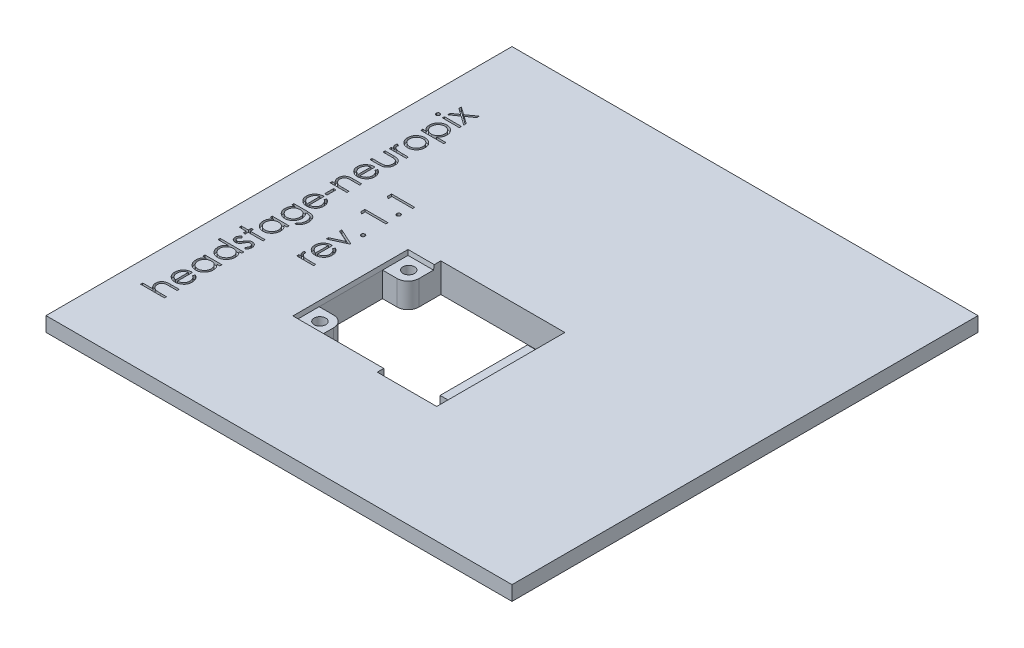
from build123d import *

# Parameters (mm, degrees)
SKETCH1_W                   = 64
SKETCH1_H                   = 64
BOSS_EXTRUDE1_DEPTH         = 4
SKETCH2_W                   = 64
SKETCH2_H                   = 64
SKETCH2_W_2                 = 60
SKETCH2_H_2                 = 60
CUT_EXTRUDE1_DEPTH          = 2
CUT_EXTRUDE2_START          = -0.6
SKETCH4_W                   = 20.2
SKETCH4_H                   = 15.6
CUT_EXTRUDE2_DEPTH          = 10
CUT_EXTRUDE2_DRAFT          = -10
TAP_DRILL_FOR_M2X0_4_TAP1_D = 1.6
CUT_EXTRUDE4_DEPTH          = 46.382375434
CUT_EXTRUDE4_DEPTH_BACK     = 46.382375434
SKETCH12_W                  = 3.124664455
SKETCH12_H                  = 12
BOSS_EXTRUDE2_DEPTH         = 2.75
SKETCH13_W                  = 0.325641026
SKETCH13_H                  = 1.221153846
SKETCH13_W_2                = 2.320192308
SKETCH13_H_2                = 0.284935897
CUT_EXTRUDE5_DEPTH          = 0.5


with BuildPart() as part:
    # Sketch1 → Boss-Extrude1 (new body)
    with BuildSketch(Plane(origin=(0, 0, 0), x_dir=(1, 0, 0), z_dir=(0, 1, 0))):
        Rectangle(SKETCH1_W, SKETCH1_H)
    extrude(amount=BOSS_EXTRUDE1_DEPTH)

    # Sketch2 → Cut-Extrude1 (cut)
    with BuildSketch(Plane.XZ):
        Rectangle(SKETCH2_W, SKETCH2_H)
        Rectangle(SKETCH2_W_2, SKETCH2_H_2, mode=Mode.SUBTRACT)
    extrude(amount=-CUT_EXTRUDE1_DEPTH, mode=Mode.SUBTRACT)


with BuildPart() as cut_extrude2_tool:
    # Sketch4 → Cut-Extrude2 (with draft: the straight prism first)
    with BuildSketch(Plane(origin=(0, 4, 0), x_dir=(1, 0, 0), z_dir=(0, 1, 0)).offset(CUT_EXTRUDE2_START)):
        with Locations((-4.8, -7.18)):
            Rectangle(SKETCH4_W, SKETCH4_H)
    extrude(amount=CUT_EXTRUDE2_DEPTH)
    # Cut-Extrude2: the draft: its side faces are tilted about the plane it starts from
    cut_extrude2_sides = [cut_extrude2_tool.faces().sort_by_distance(p)[0] for p in [
        (-4.8, 8.4, 14.98),
        (5.3, 8.4, 7.18),
        (-4.8, 8.4, -0.62),
        (-14.9, 8.4, 7.18),
    ]]
    draft(cut_extrude2_sides, Plane(origin=(0, 4, 0), x_dir=(1, 0, 0), z_dir=(0, 1, 0)).offset(CUT_EXTRUDE2_START), CUT_EXTRUDE2_DRAFT)


with BuildPart() as part_1:
    add(part.part)

    # Cut-Extrude2: cut by cut_extrude2_tool
    add(cut_extrude2_tool.part, mode=Mode.SUBTRACT)

    # Tap Drill for M2x0.4 Tap1 (through all)
    with Locations(Plane(origin=(-13.1, 4, 13.28), x_dir=(0, 0, 1), z_dir=(0, 1, 0))):
        with Locations((0, 0), (-12.2, 0)):
            Hole(TAP_DRILL_FOR_M2X0_4_TAP1_D / 2)

    # Sketch11 → Cut-Extrude4 (cut, two sides: drawn at the far end of the back side and taken through both)
    with BuildSketch(Plane(origin=(0, 3.4, 0), x_dir=(1, 0, 0), z_dir=(0, 1, 0)).offset(-CUT_EXTRUDE4_DEPTH_BACK)):
        with BuildLine():
            Line((-14.9, -11.585796188), (-12.9, -11.585796188))
            ThreePointArc((-12.9, -11.585796188), (-11.839339828, -12.025136017), (-11.4, -13.085796188))
            Line((-11.4, -13.085796188), (-11.4, -14.585796188))
            Line((-11.4, -14.585796188), (-6.532447036, -14.585796188))
            Line((-6.532447036, -14.585796188), (-6.532447036, -15.085796188))
            Line((-6.532447036, -15.085796188), (-2.525687953, -15.085796188))
            Line((-2.525687953, -15.085796188), (-2.525687953, -15.98))
            Line((-2.525687953, -15.98), (5.636904474, -15.98))
            Line((5.636904474, -15.98), (5.636904474, 1.62))
            Line((5.636904474, 1.62), (-11.4, 1.62))
            Line((-11.4, 1.62), (-11.4, -1.38))
            ThreePointArc((-11.4, -1.38), (-11.839339828, -2.440660172), (-12.9, -2.88))
            Line((-12.9, -2.88), (-14.9, -2.88))
            Line((-14.9, -2.88), (-14.9, -11.585796188))
        make_face()
    extrude(amount=CUT_EXTRUDE4_DEPTH + CUT_EXTRUDE4_DEPTH_BACK, mode=Mode.SUBTRACT)

    # Sketch12 → Boss-Extrude2 (add)
    with BuildSketch(Plane(origin=(0, 0, 0), x_dir=(1, 0, 0), z_dir=(0, 1, 0))):
        with Locations((4.865366853, -7.18)):
            Rectangle(SKETCH12_W, SKETCH12_H)
    extrude(amount=BOSS_EXTRUDE2_DEPTH)

    # Sketch13 → Cut-Extrude5 (cut)
    # profile 1 of 26: a face of its own
    with BuildSketch(Plane(origin=(0, 4, 0), x_dir=(1, 0, 0), z_dir=(0, 1, 0))):
        with BuildLine():
            Line((-29.231725515, -21.766686121), (-29.231725515, -21.481750224))
            Line((-29.231725515, -21.481750224), (-27.857291421, -21.481750224))
            add(Edge.make_bspline(
                [(-27.857291421, -21.481750224), (-27.895517748, -21.451161015), (-27.969946365, -21.391602257), (-28.067125231, -21.291405088), (-28.151168892, -21.188247645), (-28.218959834, -21.079434014), (-28.271990956, -20.965913751), (-28.308568751, -20.847524016), (-28.331892224, -20.724742407), (-28.334759953, -20.641252367), (-28.336212695, -20.598957756)],
                knots=[0, 0, 0, 0, 1.125633083, 2.191665293, 3.205031882, 4.182434329, 5.134135993, 6.080017564, 7.027370072, 8, 8, 8, 8], degree=3))
            add(Edge.make_bspline(
                [(-28.336212695, -20.598957756), (-28.334721354, -20.556000455), (-28.331800976, -20.471880509), (-28.305994462, -20.349862809), (-28.265393441, -20.235205006), (-28.207745435, -20.129595577), (-28.136548674, -20.034173188), (-28.053491507, -19.950652857), (-27.958562033, -19.881178967), (-27.870347278, -19.834629335), (-27.791864624, -19.804147812), (-27.724516721, -19.784875393), (-27.649477589, -19.768527566), (-27.566777705, -19.754286228), (-27.476022579, -19.744794092), (-27.377620893, -19.737169955), (-27.271578519, -19.731748442), (-27.198172291, -19.731538346), (-27.1602161, -19.731429711)],
                knots=[0, 0, 0, 0, 1.235771509, 2.41991536, 3.57472251, 4.727526861, 5.870395018, 6.992794988, 8.106410512, 9.245194824, 9.854018721, 10.52826073, 11.259975989, 12.064917182, 12.943387139, 13.886414983, 14.90712766, 16, 16, 16, 16], degree=3))
            Line((-27.1602161, -19.731429711), (-25.975315259, -19.731429711))
            Line((-25.975315259, -19.731429711), (-25.975315259, -20.016365608))
            Line((-25.975315259, -20.016365608), (-27.066721509, -20.016365608))
            add(Edge.make_bspline(
                [(-27.066721509, -20.016365608), (-27.098310686, -20.01653755), (-27.158735404, -20.016866446), (-27.245245561, -20.017967008), (-27.323500019, -20.020367933), (-27.393661221, -20.024391147), (-27.455634084, -20.028439442), (-27.509519834, -20.034178867), (-27.554980429, -20.040806715), (-27.58234403, -20.046765922), (-27.59461614, -20.049438525)],
                knots=[0, 0, 0, 0, 1.430934443, 2.737134061, 3.918973087, 4.976914145, 5.92044225, 6.731742364, 7.431207999, 8, 8, 8, 8], degree=3))
            add(Edge.make_bspline(
                [(-27.59461614, -20.049438525), (-27.6306508, -20.059753885), (-27.699744203, -20.079532711), (-27.793432523, -20.126422441), (-27.874027905, -20.183627712), (-27.939279752, -20.254521756), (-27.990480419, -20.336631125), (-28.025912749, -20.430858259), (-28.047911151, -20.536250508), (-28.05012362, -20.610501966), (-28.051276798, -20.649203149)],
                knots=[0, 0, 0, 0, 1.090133324, 2.090238182, 3.036763777, 3.954757083, 4.878717367, 5.838952881, 6.873623762, 8, 8, 8, 8], degree=3))
            add(Edge.make_bspline(
                [(-28.051276798, -20.649203149), (-28.050851368, -20.672126666), (-28.050009455, -20.717491716), (-28.041342822, -20.784725433), (-28.027655044, -20.850147806), (-28.007436977, -20.913583242), (-27.982855631, -20.975161142), (-27.952689401, -21.035131812), (-27.916215183, -21.092674518), (-27.875163812, -21.148531968), (-27.829750145, -21.200529762), (-27.781808658, -21.2489044), (-27.730759684, -21.292028642), (-27.677419458, -21.331097961), (-27.621057077, -21.364823989), (-27.562215865, -21.394263567), (-27.500818493, -21.419242379), (-27.458205401, -21.431654535), (-27.436883769, -21.437865008)],
                knots=[0, 0, 0, 0, 1.024369801, 2.02720137, 3.025498567, 4.008789058, 4.999724648, 5.987391013, 7.005161842, 8.042127274, 9.083588116, 10.088924978, 11.084112559, 12.068088063, 13.041783903, 14.016724555, 15.007660144, 16, 16, 16, 16], degree=3))
            add(Edge.make_bspline(
                [(-27.436883769, -21.437865008), (-27.421443335, -21.441438631), (-27.387796728, -21.449225996), (-27.332302877, -21.45767588), (-27.267817383, -21.465239453), (-27.194438053, -21.471633494), (-27.111895997, -21.475555151), (-27.020754484, -21.479780841), (-26.920442608, -21.48135384), (-26.850687398, -21.481614147), (-26.814222511, -21.481750224)],
                knots=[0, 0, 0, 0, 0.607992626, 1.324890765, 2.152360218, 3.099583803, 4.150613268, 5.323148443, 6.60066238, 8, 8, 8, 8], degree=3))
            Line((-26.814222511, -21.481750224), (-25.975315259, -21.481750224))
            Line((-25.975315259, -21.481750224), (-25.975315259, -21.766686121))
            Line((-25.975315259, -21.766686121), (-29.231725515, -21.766686121))
        make_face()
    # profile 2 of 26: a face of its own
    with BuildSketch(Plane(origin=(0, 4, 0), x_dir=(1, 0, 0), z_dir=(0, 1, 0))):
        with BuildLine():
            Line((-26.708007567, -17.175910881), (-26.575079882, -16.922775865))
            add(Edge.make_bspline(
                [(-26.575079882, -16.922775865), (-26.539307628, -16.942958216), (-26.469708987, -16.982225079), (-26.374083458, -17.049477859), (-26.288569338, -17.120623682), (-26.214535952, -17.197827234), (-26.149155279, -17.278762045), (-26.092760793, -17.364965319), (-26.044334933, -17.455733431), (-26.00465446, -17.552066146), (-25.973459378, -17.653848067), (-25.950421597, -17.761669806), (-25.937061874, -17.876040456), (-25.935440405, -17.954361322), (-25.934610131, -17.994465568)],
                knots=[0, 0, 0, 0, 1.120611642, 2.180266485, 3.186550691, 4.152466804, 5.095166165, 6.022949561, 6.960161436, 7.899497276, 8.862391909, 9.862399089, 10.905440174, 12, 12, 12, 12], degree=3))
            add(Edge.make_bspline(
                [(-25.934610131, -17.994465568), (-25.935650783, -18.039044362), (-25.937680793, -18.126004674), (-25.955181814, -18.25258716), (-25.983731741, -18.371767058), (-26.023614763, -18.483537688), (-26.075709569, -18.587625255), (-26.139172741, -18.684236922), (-26.213678701, -18.773879676), (-26.299871156, -18.853732763), (-26.392115051, -18.925608808), (-26.488218318, -18.98907577), (-26.58784814, -19.041889382), (-26.690411742, -19.085506606), (-26.795676059, -19.11991233), (-26.904243952, -19.144361569), (-27.015684916, -19.158325354), (-27.091064504, -19.160474751), (-27.129051237, -19.161557916)],
                knots=[0, 0, 0, 0, 1.14524686, 2.234044844, 3.276713788, 4.290115724, 5.276966211, 6.260758605, 7.254862358, 8.264742877, 9.274005885, 10.257798278, 11.220590477, 12.167824544, 13.118936889, 14.062732937, 15.023735098, 16, 16, 16, 16], degree=3))
            add(Edge.make_bspline(
                [(-27.129051237, -19.161557916), (-27.164697261, -19.160597124), (-27.235342975, -19.15869296), (-27.33990529, -19.146690746), (-27.441531101, -19.125419794), (-27.54030485, -19.096231272), (-27.636061157, -19.058538355), (-27.728858301, -19.012426271), (-27.818597535, -18.957823185), (-27.875206092, -18.915665831), (-27.903720708, -18.894430512)],
                knots=[0, 0, 0, 0, 1.024358464, 2.0301432, 3.019427413, 4.004406732, 4.986367066, 5.972626655, 6.978780325, 8, 8, 8, 8], degree=3))
            add(Edge.make_bspline(
                [(-27.903720708, -18.894430512), (-27.938130141, -18.865716702), (-28.005748476, -18.809290895), (-28.093786531, -18.712864548), (-28.16909556, -18.609858676), (-28.230532815, -18.499237164), (-28.277787778, -18.381186347), (-28.311399608, -18.256315122), (-28.332314424, -18.124278349), (-28.334893515, -18.033765697), (-28.336212695, -17.987469375)],
                knots=[0, 0, 0, 0, 1.030811313, 2.025658015, 2.997072178, 3.962767568, 4.930766827, 5.917075773, 6.934604948, 8, 8, 8, 8], degree=3))
            add(Edge.make_bspline(
                [(-28.336212695, -17.987469375), (-28.334990531, -17.939889168), (-28.332592924, -17.84654765), (-28.310166401, -17.710485736), (-28.275033905, -17.581488293), (-28.223847526, -17.460619869), (-28.160398513, -17.346018062), (-28.080201932, -17.240320417), (-27.987376773, -17.140625467), (-27.915915863, -17.082657329), (-27.879552038, -17.053159479)],
                knots=[0, 0, 0, 0, 1.056389096, 2.072394598, 3.055233004, 4.020130009, 4.981825462, 5.957811105, 6.960805292, 8, 8, 8, 8], degree=3))
            add(Edge.make_bspline(
                [(-27.879552038, -17.053159479), (-27.852153075, -17.033087185), (-27.797537524, -16.993076204), (-27.70848226, -16.942959192), (-27.615309078, -16.899454983), (-27.51651188, -16.864681512), (-27.413261261, -16.83652425), (-27.304819096, -16.816152707), (-27.191217676, -16.804205982), (-27.113814301, -16.801857663), (-27.074353721, -16.80066048)],
                knots=[0, 0, 0, 0, 0.94817472, 1.890038105, 2.849395472, 3.817997239, 4.812318967, 5.836947057, 6.897266129, 8, 8, 8, 8], degree=3))
            Line((-27.074353721, -16.80066048), (-27.074353721, -18.876622019))
            add(Edge.make_bspline(
                [(-27.074353721, -18.876622019), (-27.043782585, -18.875225376), (-26.98366568, -18.872478934), (-26.895699327, -18.859674482), (-26.81190351, -18.839491666), (-26.73290675, -18.811126159), (-26.657677277, -18.776775521), (-26.586773144, -18.73469705), (-26.520517307, -18.684496168), (-26.458317118, -18.628502141), (-26.402926285, -18.56617499), (-26.353349316, -18.500604213), (-26.311797096, -18.430850764), (-26.278069625, -18.357464646), (-26.251666038, -18.280564526), (-26.233643087, -18.200126178), (-26.22157164, -18.116307887), (-26.220229372, -18.059170828), (-26.219546028, -18.030082556)],
                knots=[0, 0, 0, 0, 1.094153842, 2.151609401, 3.174256925, 4.172055639, 5.149267565, 6.128595816, 7.11444997, 8.118368179, 9.117203808, 10.09244225, 11.054858984, 12.015122123, 12.976791628, 13.957293641, 14.960065497, 16, 16, 16, 16], degree=3))
            add(Edge.make_bspline(
                [(-26.219546028, -18.030082556), (-26.220093181, -18.001641345), (-26.221178836, -17.945208528), (-26.231886786, -17.861188315), (-26.248857958, -17.778383571), (-26.273301607, -17.697616524), (-26.30192479, -17.620064253), (-26.335614092, -17.547849859), (-26.37402371, -17.481928053), (-26.417671429, -17.420075121), (-26.471238644, -17.360405616), (-26.53744304, -17.300276096), (-26.617035508, -17.237224475), (-26.676542425, -17.197117842), (-26.708007567, -17.175910881)],
                knots=[0, 0, 0, 0, 0.991168677, 1.966668791, 2.94808785, 3.9350306, 4.905702032, 5.828266021, 6.709360349, 7.562606342, 8.463112863, 9.498839253, 10.677475166, 12, 12, 12, 12], degree=3))
        make_face()
        with BuildLine():
            add(Edge.make_bspline(
                [(-27.359289618, -17.085596378), (-27.397102683, -17.095983225), (-27.469691483, -17.115922598), (-27.570174301, -17.158386957), (-27.659992126, -17.205057688), (-27.737652387, -17.261240063), (-27.806735515, -17.324274534), (-27.866141192, -17.398089423), (-27.920894266, -17.479483294), (-27.966490543, -17.570077348), (-28.003959706, -17.666299008), (-28.031511124, -17.766170539), (-28.047706673, -17.868855425), (-28.050081162, -17.938016184), (-28.051276798, -17.972840969)],
                knots=[0, 0, 0, 0, 1.155085888, 2.217389643, 3.210301801, 4.133263417, 5.03575695, 5.95948047, 6.920061569, 7.923798377, 8.943125483, 9.960783337, 10.973185325, 12, 12, 12, 12], degree=3))
            add(Edge.make_bspline(
                [(-28.051276798, -17.972840969), (-28.050728394, -18.001281561), (-28.049644317, -18.057502633), (-28.039145784, -18.140294347), (-28.022275809, -18.220009827), (-27.997471107, -18.296411127), (-27.967288687, -18.370005045), (-27.930188385, -18.440738404), (-27.885333472, -18.507701912), (-27.851069038, -18.54955401), (-27.833758769, -18.57069754)],
                knots=[0, 0, 0, 0, 1.048823158, 2.073302879, 3.073550078, 4.050623576, 5.03253758, 6.005186856, 6.992227572, 8, 8, 8, 8], degree=3))
            add(Edge.make_bspline(
                [(-27.833758769, -18.57069754), (-27.820067507, -18.585843104), (-27.792359731, -18.616494036), (-27.74459506, -18.657405896), (-27.693059776, -18.696869685), (-27.635504317, -18.731939012), (-27.573597729, -18.765267202), (-27.506888294, -18.795637824), (-27.435094431, -18.823252199), (-27.385041271, -18.838753822), (-27.359289618, -18.84672919)],
                knots=[0, 0, 0, 0, 0.879905587, 1.780714457, 2.708106151, 3.677566983, 4.684151534, 5.740052498, 6.837288539, 8, 8, 8, 8], degree=3))
            Line((-27.359289618, -18.84672919), (-27.359289618, -17.085596378))
        make_face(mode=Mode.SUBTRACT)
    # profile 3 of 26: a face of its own
    with BuildSketch(Plane(origin=(0, 4, 0), x_dir=(1, 0, 0), z_dir=(0, 1, 0))):
        with BuildLine():
            Line((-28.295507567, -13.86989125), (-25.975315259, -13.86989125))
            Line((-25.975315259, -13.86989125), (-25.975315259, -14.154827147))
            Line((-25.975315259, -14.154827147), (-26.376642382, -14.154827147))
            add(Edge.make_bspline(
                [(-26.376642382, -14.154827147), (-26.340380599, -14.18700721), (-26.269510037, -14.249900398), (-26.176073611, -14.353954052), (-26.100415749, -14.465622042), (-26.038423297, -14.582102288), (-25.992044818, -14.704535745), (-25.959021161, -14.832282491), (-25.937804026, -14.965464574), (-25.935684314, -15.056407344), (-25.934610131, -15.102493413)],
                knots=[0, 0, 0, 0, 1.074325654, 2.099677833, 3.090439787, 4.057542011, 5.018572219, 5.985274637, 6.979019747, 8, 8, 8, 8], degree=3))
            add(Edge.make_bspline(
                [(-25.934610131, -15.102493413), (-25.935722626, -15.1434672), (-25.937916515, -15.224269321), (-25.954936605, -15.343131413), (-25.982269383, -15.457515096), (-26.020279475, -15.567528458), (-26.070699221, -15.672459619), (-26.131061639, -15.773206992), (-26.202944392, -15.869248649), (-26.285120674, -15.959120688), (-26.374378984, -16.041881145), (-26.469579587, -16.114508157), (-26.57031082, -16.175062736), (-26.675297324, -16.225699524), (-26.785347287, -16.26470335), (-26.900080146, -16.291893719), (-27.019360246, -16.308893981), (-27.100585385, -16.311086963), (-27.141771589, -16.312198942)],
                knots=[0, 0, 0, 0, 1.033919861, 2.038935746, 3.024066025, 3.998881131, 4.97069526, 5.957263378, 6.95902576, 7.993208707, 9.027059324, 10.027763471, 11.009749337, 11.988697705, 12.965288445, 13.950418724, 14.960734635, 16, 16, 16, 16], degree=3))
            add(Edge.make_bspline(
                [(-27.141771589, -16.312198942), (-27.18210652, -16.311062318), (-27.261846503, -16.308815273), (-27.379120751, -16.292075567), (-27.492076601, -16.263926009), (-27.6003504, -16.22442189), (-27.70407316, -16.173765259), (-27.80331824, -16.11214478), (-27.89835905, -16.039556003), (-27.986960806, -15.955869891), (-28.068803792, -15.865214778), (-28.139931997, -15.768233286), (-28.201360853, -15.667337881), (-28.250032221, -15.560963579), (-28.28941048, -15.450684848), (-28.316654672, -15.335519937), (-28.332708671, -15.215948004), (-28.335033464, -15.134767344), (-28.336212695, -15.093589166)],
                knots=[0, 0, 0, 0, 1.020392517, 2.01726096, 2.990465484, 3.961182959, 4.928053699, 5.906110375, 6.912531644, 7.948652711, 8.985773172, 9.998621852, 10.987621588, 11.969261332, 12.953316658, 13.946091881, 14.958173133, 16, 16, 16, 16], degree=3))
            add(Edge.make_bspline(
                [(-28.336212695, -15.093589166), (-28.334906996, -15.046237334), (-28.332346582, -14.953382625), (-28.311083077, -14.817545251), (-28.275050416, -14.689099719), (-28.226374693, -14.566682456), (-28.160338042, -14.451978505), (-28.079366297, -14.343559971), (-27.9801118, -14.243733466), (-27.904824577, -14.18497524), (-27.866195668, -14.154827147)],
                knots=[0, 0, 0, 0, 1.039007978, 2.037445607, 3.008437381, 3.96246474, 4.921201921, 5.904967172, 6.925065498, 8, 8, 8, 8], degree=3))
            Line((-27.866195668, -14.154827147), (-28.295507567, -14.154827147))
            Line((-28.295507567, -14.154827147), (-28.295507567, -13.86989125))
        make_face()
        with BuildLine():
            add(Edge.make_bspline(
                [(-28.051276798, -15.08977306), (-28.049793586, -15.131423028), (-28.046865964, -15.213633438), (-28.024048349, -15.334336318), (-27.985984114, -15.449779061), (-27.934231326, -15.559782153), (-27.867921235, -15.661278088), (-27.789795704, -15.753579363), (-27.698536004, -15.833839969), (-27.597408057, -15.902863897), (-27.488394618, -15.958274675), (-27.374474782, -15.997485261), (-27.257620076, -16.023297532), (-27.178371, -16.025937765), (-27.138591501, -16.027263044)],
                knots=[0, 0, 0, 0, 1.031130969, 2.035288524, 3.029955243, 4.035265425, 5.037320146, 6.024362013, 7.021230137, 8.037832003, 9.049975902, 10.039737725, 11.016035826, 12, 12, 12, 12], degree=3))
            add(Edge.make_bspline(
                [(-27.138591501, -16.027263044), (-27.099051544, -16.025564493), (-27.020126613, -16.022174047), (-26.903281937, -15.998050402), (-26.789617818, -15.957047977), (-26.679728361, -15.901712126), (-26.577612283, -15.83187584), (-26.484713454, -15.751691567), (-26.405365867, -15.658946207), (-26.338895918, -15.556542833), (-26.285235904, -15.44712399), (-26.247890467, -15.332070168), (-26.223781232, -15.213527995), (-26.220964946, -15.132926329), (-26.219546028, -15.092317131)],
                knots=[0, 0, 0, 0, 0.979154007, 1.954470061, 2.941101473, 3.965068436, 4.993389179, 5.998216918, 6.996159742, 8.005560442, 9.015493761, 10.005250788, 10.994993882, 12, 12, 12, 12], degree=3))
            add(Edge.make_bspline(
                [(-26.219546028, -15.092317131), (-26.221069249, -15.051096278), (-26.224098783, -14.969112089), (-26.246787303, -14.847916328), (-26.285694031, -14.730704433), (-26.337980649, -14.618275977), (-26.403104977, -14.51364179), (-26.479347973, -14.420049479), (-26.567408274, -14.339974054), (-26.665311919, -14.273305404), (-26.771959242, -14.220433906), (-26.885387743, -14.181774943), (-27.005827657, -14.159172073), (-27.088250933, -14.156295482), (-27.130323272, -14.154827147)],
                knots=[0, 0, 0, 0, 1.01787422, 2.024450869, 3.03297362, 4.061474925, 5.080076323, 6.069755756, 7.033548292, 8.009625779, 8.9862229, 9.964937832, 10.961217871, 12, 12, 12, 12], degree=3))
            add(Edge.make_bspline(
                [(-27.130323272, -14.154827147), (-27.162379732, -14.155697692), (-27.225476991, -14.157411201), (-27.318121239, -14.170501789), (-27.406779691, -14.191325187), (-27.491545559, -14.220667784), (-27.57195018, -14.259213449), (-27.648570877, -14.305702494), (-27.721009147, -14.360952438), (-27.788267504, -14.424073883), (-27.849614366, -14.493166603), (-27.904373356, -14.566277365), (-27.949357457, -14.644272371), (-27.986587753, -14.725839969), (-28.016214268, -14.811121679), (-28.035978819, -14.900811456), (-28.049549967, -14.993955965), (-28.050695127, -15.057497744), (-28.051276798, -15.08977306)],
                knots=[0, 0, 0, 0, 1.050140795, 2.067009409, 3.05949893, 4.030605086, 5.00011959, 5.97591094, 6.962425594, 7.979863591, 8.993523472, 9.986985069, 10.967611495, 11.937549037, 12.921786183, 13.919465291, 14.943216303, 16, 16, 16, 16], degree=3))
        make_face(mode=Mode.SUBTRACT)
    # profile 4 of 26: a face of its own
    with BuildSketch(Plane(origin=(0, 4, 0), x_dir=(1, 0, 0), z_dir=(0, 1, 0))):
        with BuildLine():
            Line((-29.231725515, -10.857711762), (-25.975315259, -10.857711762))
            Line((-25.975315259, -10.857711762), (-25.975315259, -11.14264766))
            Line((-25.975315259, -11.14264766), (-26.376642382, -11.14264766))
            add(Edge.make_bspline(
                [(-26.376642382, -11.14264766), (-26.340380599, -11.174827723), (-26.269510037, -11.23772091), (-26.176073611, -11.341774565), (-26.100415749, -11.453442555), (-26.038423297, -11.569922801), (-25.992044818, -11.692356258), (-25.959021161, -11.820103004), (-25.937804026, -11.953285087), (-25.935684314, -12.044227857), (-25.934610131, -12.090313926)],
                knots=[0, 0, 0, 0, 1.074325654, 2.099677833, 3.090439787, 4.057542011, 5.018572219, 5.985274637, 6.979019747, 8, 8, 8, 8], degree=3))
            add(Edge.make_bspline(
                [(-25.934610131, -12.090313926), (-25.935722626, -12.131287712), (-25.937916515, -12.212089834), (-25.954936605, -12.330951925), (-25.982269383, -12.445335609), (-26.020279475, -12.555348971), (-26.070699221, -12.660280132), (-26.131061639, -12.761027505), (-26.202944392, -12.857069161), (-26.285120674, -12.9469412), (-26.374378984, -13.029701658), (-26.469579587, -13.102328669), (-26.57031082, -13.162883249), (-26.675297324, -13.213520037), (-26.785347287, -13.252523863), (-26.900080146, -13.279714232), (-27.019360246, -13.296714494), (-27.100585385, -13.298907476), (-27.141771589, -13.300019455)],
                knots=[0, 0, 0, 0, 1.033919861, 2.038935746, 3.024066025, 3.998881131, 4.97069526, 5.957263378, 6.95902576, 7.993208707, 9.027059324, 10.027763471, 11.009749337, 11.988697705, 12.965288445, 13.950418724, 14.960734635, 16, 16, 16, 16], degree=3))
            add(Edge.make_bspline(
                [(-27.141771589, -13.300019455), (-27.18210652, -13.298882831), (-27.261846503, -13.296635786), (-27.379120751, -13.27989608), (-27.492076601, -13.251746522), (-27.6003504, -13.212242403), (-27.70407316, -13.161585772), (-27.80331824, -13.099965293), (-27.89835905, -13.027376516), (-27.986960806, -12.943690404), (-28.068803792, -12.853035291), (-28.139931997, -12.756053799), (-28.201360853, -12.655158394), (-28.250032221, -12.548784092), (-28.28941048, -12.438505361), (-28.316654672, -12.323340449), (-28.332708671, -12.203768517), (-28.335033464, -12.122587857), (-28.336212695, -12.081409679)],
                knots=[0, 0, 0, 0, 1.020392517, 2.01726096, 2.990465484, 3.961182959, 4.928053699, 5.906110375, 6.912531644, 7.948652711, 8.985773172, 9.998621852, 10.987621588, 11.969261332, 12.953316658, 13.946091881, 14.958173133, 16, 16, 16, 16], degree=3))
            add(Edge.make_bspline(
                [(-28.336212695, -12.081409679), (-28.334809238, -12.034036446), (-28.332054409, -11.941048055), (-28.308488298, -11.80520189), (-28.2703057, -11.676369122), (-28.216621088, -11.554274447), (-28.146158198, -11.439988509), (-28.0621594, -11.331613779), (-27.961112454, -11.231879684), (-27.88527281, -11.172845154), (-27.846479121, -11.14264766)],
                knots=[0, 0, 0, 0, 1.030935089, 2.023611011, 2.991955418, 3.950956655, 4.918431382, 5.908366361, 6.930082213, 8, 8, 8, 8], degree=3))
            Line((-27.846479121, -11.14264766), (-29.231725515, -11.14264766))
            Line((-29.231725515, -11.14264766), (-29.231725515, -10.857711762))
        make_face()
        with BuildLine():
            add(Edge.make_bspline(
                [(-28.051276798, -12.077593573), (-28.049793586, -12.119243541), (-28.046865964, -12.201453951), (-28.024048349, -12.32215683), (-27.985984114, -12.437599573), (-27.934231326, -12.547602666), (-27.867921235, -12.649098601), (-27.789795704, -12.741399876), (-27.698536004, -12.821660482), (-27.597408057, -12.89068441), (-27.488394618, -12.946095188), (-27.374474782, -12.985305774), (-27.257620076, -13.011118044), (-27.178371, -13.013758278), (-27.138591501, -13.015083557)],
                knots=[0, 0, 0, 0, 1.031130969, 2.035288524, 3.029955243, 4.035265425, 5.037320146, 6.024362013, 7.021230137, 8.037832003, 9.049975902, 10.039737725, 11.016035826, 12, 12, 12, 12], degree=3))
            add(Edge.make_bspline(
                [(-27.138591501, -13.015083557), (-27.099051544, -13.013385006), (-27.020126613, -13.00999456), (-26.903281937, -12.985870915), (-26.789617818, -12.94486849), (-26.679728361, -12.889532639), (-26.577612283, -12.819696353), (-26.484713454, -12.73951208), (-26.405365867, -12.64676672), (-26.338895918, -12.544363346), (-26.285235904, -12.434944503), (-26.247890467, -12.31989068), (-26.223781232, -12.201348508), (-26.220964946, -12.120746842), (-26.219546028, -12.080137644)],
                knots=[0, 0, 0, 0, 0.979154007, 1.954470061, 2.941101473, 3.965068436, 4.993389179, 5.998216918, 6.996159742, 8.005560442, 9.015493761, 10.005250788, 10.994993882, 12, 12, 12, 12], degree=3))
            add(Edge.make_bspline(
                [(-26.219546028, -12.080137644), (-26.221069249, -12.038916791), (-26.224098783, -11.956932602), (-26.246787303, -11.835736841), (-26.285694031, -11.718524946), (-26.337980649, -11.60609649), (-26.403104977, -11.501462303), (-26.479347973, -11.407869992), (-26.567408274, -11.327794567), (-26.665311919, -11.261125916), (-26.771959242, -11.208254419), (-26.885387743, -11.169595456), (-27.005827657, -11.146992586), (-27.088250933, -11.144115994), (-27.130323272, -11.14264766)],
                knots=[0, 0, 0, 0, 1.01787422, 2.024450869, 3.03297362, 4.061474925, 5.080076323, 6.069755756, 7.033548292, 8.009625779, 8.9862229, 9.964937832, 10.961217871, 12, 12, 12, 12], degree=3))
            add(Edge.make_bspline(
                [(-27.130323272, -11.14264766), (-27.162379732, -11.143518205), (-27.225476991, -11.145231714), (-27.318121239, -11.158322302), (-27.406779691, -11.1791457), (-27.491545559, -11.208488297), (-27.57195018, -11.247033962), (-27.648570877, -11.293523007), (-27.721009147, -11.34877295), (-27.788267504, -11.411894396), (-27.849614366, -11.480987116), (-27.904373356, -11.554097877), (-27.949357457, -11.632092884), (-27.986587753, -11.713660481), (-28.016214268, -11.798942192), (-28.035978819, -11.888631968), (-28.049549967, -11.981776478), (-28.050695127, -12.045318257), (-28.051276798, -12.077593573)],
                knots=[0, 0, 0, 0, 1.050140795, 2.067009409, 3.05949893, 4.030605086, 5.00011959, 5.97591094, 6.962425594, 7.979863591, 8.993523472, 9.986985069, 10.967611495, 11.937549037, 12.921786183, 13.919465291, 14.943216303, 16, 16, 16, 16], degree=3))
        make_face(mode=Mode.SUBTRACT)
    # profile 5 of 26: a face of its own
    with BuildSketch(Plane(origin=(0, 4, 0), x_dir=(1, 0, 0), z_dir=(0, 1, 0))):
        with BuildLine():
            Line((-28.006119546, -9.10739125), (-27.807046028, -9.300740608))
            add(Edge.make_bspline(
                [(-27.807046028, -9.300740608), (-27.826380097, -9.317423422), (-27.863653905, -9.349585924), (-27.913489672, -9.40059591), (-27.955342467, -9.451417322), (-27.99067773, -9.50135446), (-28.017392313, -9.551663032), (-28.036891224, -9.601752665), (-28.048957862, -9.651675221), (-28.050513102, -9.68504541), (-28.051276798, -9.701431714)],
                knots=[0, 0, 0, 0, 1.26578478, 2.440284043, 3.530471711, 4.527705817, 5.468200915, 6.346673037, 7.188140097, 8, 8, 8, 8], degree=3))
            add(Edge.make_bspline(
                [(-28.051276798, -9.701431714), (-28.0502992, -9.721513122), (-28.048375426, -9.76103049), (-28.029259241, -9.817691233), (-27.999785712, -9.870014193), (-27.958782583, -9.915921712), (-27.910766017, -9.954455573), (-27.856884869, -9.982260888), (-27.799202884, -9.999641005), (-27.759253866, -10.001806005), (-27.738992142, -10.00290407)],
                knots=[0, 0, 0, 0, 0.999370852, 1.966620401, 2.952450547, 3.979894107, 5.019529251, 6.00881856, 6.990093614, 8, 8, 8, 8], degree=3))
            add(Edge.make_bspline(
                [(-27.738992142, -10.00290407), (-27.720656931, -10.001896405), (-27.684038194, -9.999883914), (-27.630019621, -9.984238713), (-27.577353593, -9.959323061), (-27.545092957, -9.936036528), (-27.528470307, -9.924037884)],
                knots=[0, 0, 0, 0, 0.960159726, 1.917612774, 2.927026955, 4, 4, 4, 4], degree=3))
            add(Edge.make_bspline(
                [(-27.528470307, -9.924037884), (-27.519633606, -9.916776697), (-27.50071192, -9.901228598), (-27.473783784, -9.873027148), (-27.445626723, -9.839619666), (-27.416431763, -9.800688977), (-27.386168321, -9.756156833), (-27.354322312, -9.706675848), (-27.321825947, -9.651634474), (-27.300460603, -9.612871222), (-27.289327679, -9.5926727)],
                knots=[0, 0, 0, 0, 0.667332049, 1.428932371, 2.272176193, 3.217953793, 4.268659351, 5.415594948, 6.6533338, 8, 8, 8, 8], degree=3))
            add(Edge.make_bspline(
                [(-27.289327679, -9.5926727), (-27.27550419, -9.567981679), (-27.24880176, -9.520286758), (-27.207258268, -9.452589208), (-27.166244562, -9.390787103), (-27.124822912, -9.335733769), (-27.084697179, -9.286138311), (-27.044758108, -9.242797681), (-27.004900137, -9.205577644), (-26.977015167, -9.184759714), (-26.963686653, -9.174809118)],
                knots=[0, 0, 0, 0, 1.271974443, 2.457035787, 3.569878245, 4.604907449, 5.553098313, 6.436573686, 7.252710343, 8, 8, 8, 8], degree=3))
            add(Edge.make_bspline(
                [(-26.963686653, -9.174809118), (-26.936784118, -9.158264931), (-26.883074702, -9.125235383), (-26.79473669, -9.091128513), (-26.701302489, -9.070788335), (-26.637513696, -9.068071882), (-26.604972711, -9.066686121)],
                knots=[0, 0, 0, 0, 0.995432674, 1.98732596, 2.973261739, 4, 4, 4, 4], degree=3))
            add(Edge.make_bspline(
                [(-26.604972711, -9.066686121), (-26.582050025, -9.067338894), (-26.536878368, -9.068625255), (-26.470352635, -9.07756717), (-26.406732652, -9.092950548), (-26.345315747, -9.113889662), (-26.287324459, -9.142216758), (-26.231269275, -9.175140839), (-26.17884357, -9.215365782), (-26.129131915, -9.260558717), (-26.083663242, -9.310312502), (-26.043880305, -9.363597893), (-26.009834139, -9.419668223), (-25.982546862, -9.4793362), (-25.960655498, -9.541861532), (-25.945556147, -9.607558413), (-25.936505088, -9.676161912), (-25.93524977, -9.722816452), (-25.934610131, -9.746588966)],
                knots=[0, 0, 0, 0, 1.03294705, 2.035535002, 3.018074688, 3.978914202, 4.953244146, 5.921606783, 6.903774788, 7.924990491, 8.946206195, 9.936011882, 10.917482605, 11.896392379, 12.887442265, 13.897874922, 14.928876017, 16, 16, 16, 16], degree=3))
            add(Edge.make_bspline(
                [(-25.934610131, -9.746588966), (-25.935506573, -9.778673639), (-25.937287002, -9.84239717), (-25.954134834, -9.936616491), (-25.980047882, -10.028877367), (-26.016992768, -10.11785417), (-26.06241312, -10.202187636), (-26.116152771, -10.279804468), (-26.177927656, -10.349897117), (-26.225177778, -10.38993594), (-26.248802839, -10.409955352)],
                knots=[0, 0, 0, 0, 1.014105853, 2.01412079, 3.018242674, 4.040740662, 5.055023907, 6.042888753, 7.021444376, 8, 8, 8, 8], degree=3))
            Line((-26.248802839, -10.409955352), (-26.463776798, -10.221058117))
            add(Edge.make_bspline(
                [(-26.463776798, -10.221058117), (-26.444404975, -10.203121713), (-26.406849769, -10.168349284), (-26.356844117, -10.112740323), (-26.314932964, -10.056153295), (-26.279877866, -9.999153257), (-26.252867322, -9.940896458), (-26.233891169, -9.881709365), (-26.221695366, -9.821712366), (-26.220263639, -9.781415143), (-26.219546028, -9.761217371)],
                knots=[0, 0, 0, 0, 1.179806542, 2.287233372, 3.337373186, 4.324005949, 5.273901747, 6.200048787, 7.097828587, 8, 8, 8, 8], degree=3))
            add(Edge.make_bspline(
                [(-26.219546028, -9.761217371), (-26.220789673, -9.733714885), (-26.223219546, -9.679979639), (-26.245277064, -9.603011369), (-26.279872214, -9.531957758), (-26.328912532, -9.470210056), (-26.385967324, -9.417955572), (-26.450001142, -9.379355377), (-26.519869327, -9.355966439), (-26.568333099, -9.353082986), (-26.592888376, -9.351622019)],
                knots=[0, 0, 0, 0, 1.072236613, 2.094970478, 3.102399718, 4.141104368, 5.155589565, 6.110053346, 7.042415349, 8, 8, 8, 8], degree=3))
            add(Edge.make_bspline(
                [(-26.592888376, -9.351622019), (-26.613135404, -9.352577019), (-26.652904759, -9.354452836), (-26.710602772, -9.370103075), (-26.765647344, -9.393773944), (-26.797883678, -9.417716843), (-26.814222511, -9.429852187)],
                knots=[0, 0, 0, 0, 1.014054094, 1.991812201, 2.982159616, 4, 4, 4, 4], degree=3))
            add(Edge.make_bspline(
                [(-26.814222511, -9.429852187), (-26.822421123, -9.43712807), (-26.84028066, -9.452977571), (-26.866022206, -9.482087128), (-26.893945254, -9.516664215), (-26.922360599, -9.558244596), (-26.953839193, -9.604730412), (-26.98505581, -9.658604482), (-27.019101827, -9.717778755), (-27.041603026, -9.759671322), (-27.053365139, -9.781569935)],
                knots=[0, 0, 0, 0, 0.615029206, 1.339755737, 2.178261527, 3.109653826, 4.166232585, 5.329982127, 6.604294388, 8, 8, 8, 8], degree=3))
            add(Edge.make_bspline(
                [(-27.053365139, -9.781569935), (-27.066554208, -9.805197959), (-27.092132023, -9.851020237), (-27.131970182, -9.915923851), (-27.172489781, -9.974477522), (-27.211417856, -10.028090186), (-27.250806856, -10.07540767), (-27.290700505, -10.116243566), (-27.329489921, -10.152205626), (-27.356973897, -10.172115064), (-27.370101918, -10.181625024)],
                knots=[0, 0, 0, 0, 1.262093308, 2.447601706, 3.550203992, 4.582594899, 5.537233252, 6.418365656, 7.244515135, 8, 8, 8, 8], degree=3))
            add(Edge.make_bspline(
                [(-27.370101918, -10.181625024), (-27.396549413, -10.198048231), (-27.449284928, -10.230795617), (-27.537416122, -10.263156886), (-27.630448993, -10.28478743), (-27.694765748, -10.286809467), (-27.727543825, -10.287839967)],
                knots=[0, 0, 0, 0, 0.984940175, 1.963941237, 2.962352981, 4, 4, 4, 4], degree=3))
            add(Edge.make_bspline(
                [(-27.727543825, -10.287839967), (-27.748975718, -10.287356019), (-27.790920971, -10.286408863), (-27.852547205, -10.278830564), (-27.911116131, -10.265082545), (-27.967606888, -10.247620021), (-28.021035145, -10.223923369), (-28.071647939, -10.195018144), (-28.119500387, -10.161311986), (-28.16394494, -10.122437109), (-28.204340729, -10.079715619), (-28.239469256, -10.033513919), (-28.26969801, -9.985143524), (-28.293946766, -9.933624094), (-28.313207899, -9.879561174), (-28.326256852, -9.822547773), (-28.335033559, -9.762974283), (-28.335813989, -9.722241338), (-28.336212695, -9.701431714)],
                knots=[0, 0, 0, 0, 1.087304385, 2.128008728, 3.143103065, 4.136477636, 5.123835063, 6.101831209, 7.089715868, 8.088492253, 9.092987035, 10.067605355, 11.028834439, 11.98153898, 12.951158004, 13.934816901, 14.944940436, 16, 16, 16, 16], degree=3))
            add(Edge.make_bspline(
                [(-28.336212695, -9.701431714), (-28.3352109, -9.676764628), (-28.333188518, -9.626967727), (-28.317126927, -9.552260316), (-28.29069904, -9.477662927), (-28.254199028, -9.402983888), (-28.206966934, -9.328770269), (-28.149881069, -9.254369263), (-28.083317, -9.178887693), (-28.032426988, -9.131755894), (-28.006119546, -9.10739125)],
                knots=[0, 0, 0, 0, 0.845714091, 1.707292901, 2.609013841, 3.555613372, 4.552488639, 5.621697636, 6.770543573, 8, 8, 8, 8], degree=3))
        make_face()
    # profile 6 of 26: a face of its own
    with BuildSketch(Plane(origin=(0, 4, 0), x_dir=(1, 0, 0), z_dir=(0, 1, 0))):
        Polygon((-29.231725515, -8.211878429), (-29.231725515, -7.926942532), (-28.295507567, -7.926942532), (-28.295507567, -7.51989125), (-28.010571669, -7.51989125), (-28.010571669, -7.926942532), (-25.975315259, -7.926942532), (-25.975315259, -8.211878429), (-28.010571669, -8.211878429), (-28.010571669, -8.618929711), (-28.295507567, -8.618929711), (-28.295507567, -8.211878429), align=None)
    # profile 7 of 26: a face of its own
    with BuildSketch(Plane(origin=(0, 4, 0), x_dir=(1, 0, 0), z_dir=(0, 1, 0))):
        with BuildLine():
            Line((-28.295507567, -4.629827147), (-25.975315259, -4.629827147))
            Line((-25.975315259, -4.629827147), (-25.975315259, -4.914763044))
            Line((-25.975315259, -4.914763044), (-26.376642382, -4.914763044))
            add(Edge.make_bspline(
                [(-26.376642382, -4.914763044), (-26.340380599, -4.946943107), (-26.269510037, -5.009836295), (-26.176073611, -5.11388995), (-26.100415749, -5.225557939), (-26.038423297, -5.342038186), (-25.992044818, -5.464471642), (-25.959021161, -5.592218389), (-25.937804026, -5.725400472), (-25.935684314, -5.816343241), (-25.934610131, -5.86242931)],
                knots=[0, 0, 0, 0, 1.074325654, 2.099677833, 3.090439787, 4.057542011, 5.018572219, 5.985274637, 6.979019747, 8, 8, 8, 8], degree=3))
            add(Edge.make_bspline(
                [(-25.934610131, -5.86242931), (-25.935722626, -5.903403097), (-25.937916515, -5.984205219), (-25.954936605, -6.10306731), (-25.982269383, -6.217450994), (-26.020279475, -6.327464356), (-26.070699221, -6.432395516), (-26.131061639, -6.53314289), (-26.202944392, -6.629184546), (-26.285120674, -6.719056585), (-26.374378984, -6.801817043), (-26.469579587, -6.874444054), (-26.57031082, -6.934998634), (-26.675297324, -6.985635421), (-26.785347287, -7.024639248), (-26.900080146, -7.051829616), (-27.019360246, -7.068829879), (-27.100585385, -7.071022861), (-27.141771589, -7.072134839)],
                knots=[0, 0, 0, 0, 1.033919861, 2.038935746, 3.024066025, 3.998881131, 4.97069526, 5.957263378, 6.95902576, 7.993208707, 9.027059324, 10.027763471, 11.009749337, 11.988697705, 12.965288445, 13.950418724, 14.960734635, 16, 16, 16, 16], degree=3))
            add(Edge.make_bspline(
                [(-27.141771589, -7.072134839), (-27.18210652, -7.070998215), (-27.261846503, -7.068751171), (-27.379120751, -7.052011464), (-27.492076601, -7.023861906), (-27.6003504, -6.984357787), (-27.70407316, -6.933701157), (-27.80331824, -6.872080678), (-27.89835905, -6.799491901), (-27.986960806, -6.715805788), (-28.068803792, -6.625150675), (-28.139931997, -6.528169184), (-28.201360853, -6.427273779), (-28.250032221, -6.320899476), (-28.28941048, -6.210620745), (-28.316654672, -6.095455834), (-28.332708671, -5.975883902), (-28.335033464, -5.894703241), (-28.336212695, -5.853525064)],
                knots=[0, 0, 0, 0, 1.020392517, 2.01726096, 2.990465484, 3.961182959, 4.928053699, 5.906110375, 6.912531644, 7.948652711, 8.985773172, 9.998621852, 10.987621588, 11.969261332, 12.953316658, 13.946091881, 14.958173133, 16, 16, 16, 16], degree=3))
            add(Edge.make_bspline(
                [(-28.336212695, -5.853525064), (-28.334906996, -5.806173231), (-28.332346582, -5.713318523), (-28.311083077, -5.577481148), (-28.275050416, -5.449035616), (-28.226374693, -5.326618353), (-28.160338042, -5.211914402), (-28.079366297, -5.103495868), (-27.9801118, -5.003669363), (-27.904824577, -4.944911137), (-27.866195668, -4.914763044)],
                knots=[0, 0, 0, 0, 1.039007978, 2.037445607, 3.008437381, 3.96246474, 4.921201921, 5.904967172, 6.925065498, 8, 8, 8, 8], degree=3))
            Line((-27.866195668, -4.914763044), (-28.295507567, -4.914763044))
            Line((-28.295507567, -4.914763044), (-28.295507567, -4.629827147))
        make_face()
        with BuildLine():
            add(Edge.make_bspline(
                [(-28.051276798, -5.849708958), (-28.049793586, -5.891358925), (-28.046865964, -5.973569336), (-28.024048349, -6.094272215), (-27.985984114, -6.209714958), (-27.934231326, -6.31971805), (-27.867921235, -6.421213986), (-27.789795704, -6.513515261), (-27.698536004, -6.593775867), (-27.597408057, -6.662799794), (-27.488394618, -6.718210572), (-27.374474782, -6.757421159), (-27.257620076, -6.783233429), (-27.178371, -6.785873662), (-27.138591501, -6.787198942)],
                knots=[0, 0, 0, 0, 1.031130969, 2.035288524, 3.029955243, 4.035265425, 5.037320146, 6.024362013, 7.021230137, 8.037832003, 9.049975902, 10.039737725, 11.016035826, 12, 12, 12, 12], degree=3))
            add(Edge.make_bspline(
                [(-27.138591501, -6.787198942), (-27.099051544, -6.78550039), (-27.020126613, -6.782109944), (-26.903281937, -6.7579863), (-26.789617818, -6.716983875), (-26.679728361, -6.661648024), (-26.577612283, -6.591811737), (-26.484713454, -6.511627464), (-26.405365867, -6.418882104), (-26.338895918, -6.31647873), (-26.285235904, -6.207059887), (-26.247890467, -6.092006065), (-26.223781232, -5.973463892), (-26.220964946, -5.892862227), (-26.219546028, -5.852253028)],
                knots=[0, 0, 0, 0, 0.979154007, 1.954470061, 2.941101473, 3.965068436, 4.993389179, 5.998216918, 6.996159742, 8.005560442, 9.015493761, 10.005250788, 10.994993882, 12, 12, 12, 12], degree=3))
            add(Edge.make_bspline(
                [(-26.219546028, -5.852253028), (-26.221069249, -5.811032175), (-26.224098783, -5.729047987), (-26.246787303, -5.607852225), (-26.285694031, -5.490640331), (-26.337980649, -5.378211875), (-26.403104977, -5.273577687), (-26.479347973, -5.179985376), (-26.567408274, -5.099909952), (-26.665311919, -5.033241301), (-26.771959242, -4.980369804), (-26.885387743, -4.941710841), (-27.005827657, -4.919107971), (-27.088250933, -4.916231379), (-27.130323272, -4.914763044)],
                knots=[0, 0, 0, 0, 1.01787422, 2.024450869, 3.03297362, 4.061474925, 5.080076323, 6.069755756, 7.033548292, 8.009625779, 8.9862229, 9.964937832, 10.961217871, 12, 12, 12, 12], degree=3))
            add(Edge.make_bspline(
                [(-27.130323272, -4.914763044), (-27.162379732, -4.91563359), (-27.225476991, -4.917347099), (-27.318121239, -4.930437687), (-27.406779691, -4.951261084), (-27.491545559, -4.980603681), (-27.57195018, -5.019149347), (-27.648570877, -5.065638391), (-27.721009147, -5.120888335), (-27.788267504, -5.184009781), (-27.849614366, -5.2531025), (-27.904373356, -5.326213262), (-27.949357457, -5.404208268), (-27.986587753, -5.485775866), (-28.016214268, -5.571057577), (-28.035978819, -5.660747353), (-28.049549967, -5.753891863), (-28.050695127, -5.817433641), (-28.051276798, -5.849708958)],
                knots=[0, 0, 0, 0, 1.050140795, 2.067009409, 3.05949893, 4.030605086, 5.00011959, 5.97591094, 6.962425594, 7.979863591, 8.993523472, 9.986985069, 10.967611495, 11.937549037, 12.921786183, 13.919465291, 14.943216303, 16, 16, 16, 16], degree=3))
        make_face(mode=Mode.SUBTRACT)
    # profile 8 of 26: a face of its own
    with BuildSketch(Plane(origin=(0, 4, 0), x_dir=(1, 0, 0), z_dir=(0, 1, 0))):
        with BuildLine():
            Line((-28.295507567, -1.943288685), (-28.295507567, -1.658352788))
            Line((-28.295507567, -1.658352788), (-26.454236533, -1.658352788))
            add(Edge.make_bspline(
                [(-26.454236533, -1.658352788), (-26.415013858, -1.658604105), (-26.339304647, -1.659089208), (-26.229832208, -1.662582589), (-26.128716544, -1.669949203), (-26.035496496, -1.678302793), (-25.950604153, -1.690319457), (-25.873786203, -1.704993733), (-25.804968928, -1.721536099), (-25.762582823, -1.736068725), (-25.742532807, -1.742943133)],
                knots=[0, 0, 0, 0, 1.307562039, 2.523909702, 3.650326591, 4.686913197, 5.643429486, 6.506965704, 7.293745905, 8, 8, 8, 8], degree=3))
            add(Edge.make_bspline(
                [(-25.742532807, -1.742943133), (-25.716470725, -1.75309342), (-25.6651258, -1.773090507), (-25.592340932, -1.810541769), (-25.523812816, -1.852485137), (-25.459903931, -1.900378721), (-25.401007445, -1.954064062), (-25.345662186, -2.011964581), (-25.295950343, -2.076111558), (-25.251274848, -2.145381742), (-25.210250321, -2.218376539), (-25.175250086, -2.295644828), (-25.146058403, -2.376771495), (-25.122038713, -2.461382213), (-25.102660679, -2.54947204), (-25.089731378, -2.64133421), (-25.081025353, -2.73665828), (-25.080214049, -2.801468338), (-25.079802439, -2.834349383)],
                knots=[0, 0, 0, 0, 0.98202571, 1.934689484, 2.871054655, 3.802072519, 4.735470746, 5.668036537, 6.612630213, 7.581518814, 8.561763468, 9.551722253, 10.55777311, 11.588015789, 12.63986657, 13.723744117, 14.845153492, 16, 16, 16, 16], degree=3))
            add(Edge.make_bspline(
                [(-25.079802439, -2.834349383), (-25.080676829, -2.882309971), (-25.082384291, -2.975964793), (-25.098705145, -3.112789655), (-25.125030903, -3.242311536), (-25.16253896, -3.363586469), (-25.208921086, -3.475394268), (-25.262054309, -3.577110531), (-25.323009741, -3.667797647), (-25.392405401, -3.749552939), (-25.474922821, -3.823341313), (-25.572167376, -3.892762518), (-25.685620945, -3.959583509), (-25.768890044, -3.998743631), (-25.812494746, -4.019250224)],
                knots=[0, 0, 0, 0, 1.157856589, 2.260999188, 3.322382479, 4.345906448, 5.321474636, 6.242187631, 7.112686896, 7.955149481, 8.825136643, 9.778649332, 10.836767353, 12, 12, 12, 12], degree=3))
            Line((-25.812494746, -4.019250224), (-25.812494746, -3.734314326))
            add(Edge.make_bspline(
                [(-25.812494746, -3.734314326), (-25.776124651, -3.711387504), (-25.705025595, -3.66656839), (-25.61287662, -3.583033298), (-25.534847961, -3.490813264), (-25.471536655, -3.387951573), (-25.422797395, -3.273730821), (-25.388943645, -3.147412042), (-25.368462321, -3.008649539), (-25.366013521, -2.912017949), (-25.364738336, -2.861698141)],
                knots=[0, 0, 0, 0, 0.997887113, 1.950746426, 2.877762071, 3.798308985, 4.747694893, 5.754452072, 6.830656281, 8, 8, 8, 8], degree=3))
            add(Edge.make_bspline(
                [(-25.364738336, -2.861698141), (-25.366030257, -2.812014559), (-25.368520952, -2.716229586), (-25.388951777, -2.578526294), (-25.422807925, -2.45261955), (-25.471437237, -2.33989995), (-25.529848721, -2.241068745), (-25.594450226, -2.15537978), (-25.668158431, -2.086525365), (-25.735959119, -2.040036561), (-25.796402395, -2.01116544), (-25.848426033, -1.992762891), (-25.907064892, -1.97792145), (-25.972458898, -1.965181152), (-26.044633152, -1.955085909), (-26.123833786, -1.948462413), (-26.209525109, -1.943761383), (-26.268936263, -1.943449895), (-26.299684249, -1.943288685)],
                knots=[0, 0, 0, 0, 1.570880491, 3.028500349, 4.391799536, 5.683507043, 6.897971719, 8.016608159, 9.065046722, 10.074948333, 10.602832593, 11.179761774, 11.817338097, 12.514350094, 13.286299219, 14.121078732, 15.027572402, 16, 16, 16, 16], degree=3))
            Line((-26.299684249, -1.943288685), (-26.419891581, -1.943288685))
            add(Edge.make_bspline(
                [(-26.419891581, -1.943288685), (-26.385486915, -1.972219153), (-26.317282752, -2.02957121), (-26.227751137, -2.128349761), (-26.151573874, -2.236921768), (-26.088209644, -2.353752529), (-26.038006872, -2.477100875), (-26.001630583, -2.604785992), (-25.979067385, -2.736449419), (-25.976574838, -2.825567592), (-25.975315259, -2.870602387)],
                knots=[0, 0, 0, 0, 1.012670515, 2.007528466, 2.995541538, 3.996581493, 4.997861088, 5.991949332, 6.98525577, 8, 8, 8, 8], degree=3))
            add(Edge.make_bspline(
                [(-25.975315259, -2.870602387), (-25.975874845, -2.897113789), (-25.976986977, -2.949803123), (-25.983752149, -3.028301623), (-25.996926223, -3.105287259), (-26.013795685, -3.181250437), (-26.036408728, -3.25566046), (-26.06294921, -3.329408894), (-26.095547941, -3.40142474), (-26.132249639, -3.472075444), (-26.173486548, -3.539698819), (-26.218039768, -3.604082245), (-26.265814327, -3.66482974), (-26.317244973, -3.721378512), (-26.372266808, -3.77365033), (-26.430290778, -3.822349314), (-26.49212778, -3.866669895), (-26.556650083, -3.907521616), (-26.624287495, -3.942952393), (-26.693573338, -3.974053216), (-26.764359469, -4.001094605), (-26.836882875, -4.022653219), (-26.911097837, -4.039118872), (-26.986882773, -4.051374578), (-27.064471053, -4.058325952), (-27.116741848, -4.059409918), (-27.143043624, -4.059955352)],
                knots=[0, 0, 0, 0, 1.028710361, 2.044481286, 3.053267669, 4.056977562, 5.061496029, 6.068537106, 7.095799505, 8.125955792, 9.155750787, 10.166547241, 11.162135275, 12.151998358, 13.129411568, 14.10464185, 15.088574784, 16.079052837, 17.065149435, 18.048153627, 19.024354702, 20.002874835, 20.980703288, 21.971932454, 22.97951087, 24, 24, 24, 24], degree=3))
            add(Edge.make_bspline(
                [(-27.143043624, -4.059955352), (-27.169353576, -4.059484394), (-27.221871576, -4.058544302), (-27.299776447, -4.050424485), (-27.376638149, -4.038841913), (-27.451664435, -4.02051058), (-27.525709746, -3.998446578), (-27.59822716, -3.971120194), (-27.669238764, -3.938264605), (-27.738797146, -3.901062904), (-27.805968911, -3.859258048), (-27.869765226, -3.813417869), (-27.929716639, -3.763487026), (-27.986427964, -3.71015436), (-28.039352033, -3.652768668), (-28.088360394, -3.59135964), (-28.134274547, -3.526532598), (-28.176104117, -3.458086629), (-28.21309944, -3.387077855), (-28.246856582, -3.31531032), (-28.273648248, -3.24183335), (-28.297254916, -3.168016832), (-28.313978272, -3.092560766), (-28.326879877, -3.016390345), (-28.334740017, -2.939244796), (-28.335721169, -2.887580384), (-28.336212695, -2.861698141)],
                knots=[0, 0, 0, 0, 1.008818848, 2.013730394, 3.001654427, 3.987803273, 4.973046549, 5.963777569, 6.957074694, 7.972068341, 8.987420212, 9.989399531, 10.982630087, 11.977756091, 12.973280677, 13.973972381, 14.989194003, 16.018387222, 17.047741039, 18.059210846, 19.057554164, 20.045176975, 21.029480261, 22.018708529, 23.007435371, 24, 24, 24, 24], degree=3))
            add(Edge.make_bspline(
                [(-28.336212695, -2.861698141), (-28.334981998, -2.819016217), (-28.332551751, -2.734732534), (-28.313482569, -2.610697981), (-28.283080571, -2.491007521), (-28.239523535, -2.37498575), (-28.180060286, -2.261687552), (-28.101734898, -2.151486336), (-28.003844804, -2.044063264), (-27.928776134, -1.977771232), (-27.88972832, -1.943288685)],
                knots=[0, 0, 0, 0, 0.96728863, 1.910097829, 2.838038873, 3.762875196, 4.71315279, 5.730631239, 6.819562287, 8, 8, 8, 8], degree=3))
            Line((-27.88972832, -1.943288685), (-28.295507567, -1.943288685))
        make_face()
        with BuildLine():
            add(Edge.make_bspline(
                [(-28.051276798, -2.838801506), (-28.049855491, -2.880464566), (-28.047041606, -2.962948591), (-28.023182608, -3.083898759), (-27.985418786, -3.200394579), (-27.932855969, -3.311287387), (-27.866425901, -3.414022644), (-27.78739152, -3.505962395), (-27.696837096, -3.586120874), (-27.595929186, -3.653946769), (-27.486894877, -3.708129414), (-27.372017481, -3.745978259), (-27.253303717, -3.770995912), (-27.172427327, -3.773669594), (-27.131595307, -3.775019455)],
                knots=[0, 0, 0, 0, 1.026191648, 2.031641866, 3.026511193, 4.038688626, 5.047555432, 6.033268986, 7.01798463, 8.019529538, 9.022150945, 10.008736843, 10.994672018, 12, 12, 12, 12], degree=3))
            add(Edge.make_bspline(
                [(-27.131595307, -3.775019455), (-27.100813979, -3.774358444), (-27.040276107, -3.77305843), (-26.951418226, -3.760646896), (-26.866656641, -3.740341494), (-26.786071853, -3.712287621), (-26.709653592, -3.676440265), (-26.637407194, -3.632226643), (-26.569292218, -3.579893661), (-26.505883438, -3.52016044), (-26.448135015, -3.454320666), (-26.39739091, -3.382911806), (-26.355888553, -3.3060265), (-26.320019342, -3.225556801), (-26.293821908, -3.139549887), (-26.273829586, -3.049244649), (-26.262391642, -2.95400218), (-26.260973961, -2.889076388), (-26.260251157, -2.855973982)],
                knots=[0, 0, 0, 0, 1.039710933, 2.044807362, 3.024849673, 3.981007225, 4.923240656, 5.871799057, 6.837597342, 7.820855272, 8.810901995, 9.792827897, 10.773995565, 11.758948565, 12.765014796, 13.806304263, 14.881544521, 16, 16, 16, 16], degree=3))
            add(Edge.make_bspline(
                [(-26.260251157, -2.855973982), (-26.260947488, -2.822442573), (-26.262309156, -2.756872257), (-26.274014472, -2.661104336), (-26.292902979, -2.57036035), (-26.319720866, -2.484723504), (-26.353939883, -2.403870459), (-26.397243815, -2.328709488), (-26.446560121, -2.257628995), (-26.504083877, -2.192898538), (-26.567479551, -2.134365902), (-26.636463134, -2.083356564), (-26.709996605, -2.039891314), (-26.788071674, -2.003897999), (-26.871295095, -1.976419549), (-26.959458817, -1.9579874), (-27.052140459, -1.945099852), (-27.115648275, -1.943901585), (-27.148131765, -1.943288685)],
                knots=[0, 0, 0, 0, 1.121943988, 2.193949579, 3.223793937, 4.220241907, 5.192961521, 6.155822191, 7.11847367, 8.083710714, 9.04790392, 10.001595906, 10.949595423, 11.902125208, 12.873731292, 13.87582262, 14.913508608, 16, 16, 16, 16], degree=3))
            add(Edge.make_bspline(
                [(-27.148131765, -1.943288685), (-27.19041992, -1.944506045), (-27.273036113, -1.946884339), (-27.393432723, -1.969257595), (-27.506752191, -2.005550798), (-27.612704558, -2.055919948), (-27.709814049, -2.11932868), (-27.795621601, -2.19644998), (-27.872493708, -2.283871305), (-27.935700653, -2.383730555), (-27.987221453, -2.4906146), (-28.024619882, -2.602947067), (-28.046635847, -2.719641275), (-28.049720911, -2.798852827), (-28.051276798, -2.838801506)],
                knots=[0, 0, 0, 0, 1.070678282, 2.091729125, 3.090678259, 4.078281522, 5.055707048, 6.018451281, 6.993304669, 7.996175111, 9.002951586, 9.993356152, 10.987991402, 12, 12, 12, 12], degree=3))
        make_face(mode=Mode.SUBTRACT)
    # profile 9 of 26: a face of its own
    with BuildSketch(Plane(origin=(0, 4, 0), x_dir=(1, 0, 0), z_dir=(0, 1, 0))):
        with BuildLine():
            Line((-26.708007567, 0.897166042), (-26.575079882, 1.150301058))
            add(Edge.make_bspline(
                [(-26.575079882, 1.150301058), (-26.539307628, 1.130118707), (-26.469708987, 1.090851844), (-26.374083458, 1.023599064), (-26.288569338, 0.952453241), (-26.214535952, 0.875249689), (-26.149155279, 0.794314878), (-26.092760793, 0.708111604), (-26.044334933, 0.617343492), (-26.00465446, 0.521010777), (-25.973459378, 0.419228856), (-25.950421597, 0.311407117), (-25.937061874, 0.197036467), (-25.935440405, 0.118715601), (-25.934610131, 0.078611355)],
                knots=[0, 0, 0, 0, 1.120611642, 2.180266485, 3.186550691, 4.152466804, 5.095166165, 6.022949561, 6.960161436, 7.899497276, 8.862391909, 9.862399089, 10.905440174, 12, 12, 12, 12], degree=3))
            add(Edge.make_bspline(
                [(-25.934610131, 0.078611355), (-25.935650783, 0.034032561), (-25.937680793, -0.052927751), (-25.955181814, -0.179510237), (-25.983731741, -0.298690135), (-26.023614763, -0.410460764), (-26.075709569, -0.514548331), (-26.139172741, -0.611159999), (-26.213678701, -0.700802753), (-26.299871156, -0.78065584), (-26.392115051, -0.852531885), (-26.488218318, -0.915998847), (-26.58784814, -0.968812458), (-26.690411742, -1.012429683), (-26.795676059, -1.046835407), (-26.904243952, -1.071284646), (-27.015684916, -1.08524843), (-27.091064504, -1.087397828), (-27.129051237, -1.088480993)],
                knots=[0, 0, 0, 0, 1.14524686, 2.234044844, 3.276713788, 4.290115724, 5.276966211, 6.260758605, 7.254862358, 8.264742877, 9.274005885, 10.257798278, 11.220590477, 12.167824544, 13.118936889, 14.062732937, 15.023735098, 16, 16, 16, 16], degree=3))
            add(Edge.make_bspline(
                [(-27.129051237, -1.088480993), (-27.164697261, -1.087520201), (-27.235342975, -1.085616037), (-27.33990529, -1.073613822), (-27.441531101, -1.052342871), (-27.54030485, -1.023154348), (-27.636061157, -0.985461432), (-27.728858301, -0.939349348), (-27.818597535, -0.884746262), (-27.875206092, -0.842588908), (-27.903720708, -0.821353589)],
                knots=[0, 0, 0, 0, 1.024358464, 2.0301432, 3.019427413, 4.004406732, 4.986367066, 5.972626655, 6.978780325, 8, 8, 8, 8], degree=3))
            add(Edge.make_bspline(
                [(-27.903720708, -0.821353589), (-27.938130141, -0.792639779), (-28.005748476, -0.736213972), (-28.093786531, -0.639787625), (-28.16909556, -0.536781753), (-28.230532815, -0.426160241), (-28.277787778, -0.308109424), (-28.311399608, -0.183238199), (-28.332314424, -0.051201426), (-28.334893515, 0.039311226), (-28.336212695, 0.085607549)],
                knots=[0, 0, 0, 0, 1.030811313, 2.025658015, 2.997072178, 3.962767568, 4.930766827, 5.917075773, 6.934604948, 8, 8, 8, 8], degree=3))
            add(Edge.make_bspline(
                [(-28.336212695, 0.085607549), (-28.334990531, 0.133187755), (-28.332592924, 0.226529273), (-28.310166401, 0.362591187), (-28.275033905, 0.49158863), (-28.223847526, 0.612457054), (-28.160398513, 0.727058862), (-28.080201932, 0.832756506), (-27.987376773, 0.932451456), (-27.915915863, 0.990419594), (-27.879552038, 1.019917444)],
                knots=[0, 0, 0, 0, 1.056389096, 2.072394598, 3.055233004, 4.020130009, 4.981825462, 5.957811105, 6.960805292, 8, 8, 8, 8], degree=3))
            add(Edge.make_bspline(
                [(-27.879552038, 1.019917444), (-27.852153075, 1.039989738), (-27.797537524, 1.080000719), (-27.70848226, 1.130117731), (-27.615309078, 1.17362194), (-27.51651188, 1.208395412), (-27.413261261, 1.236552673), (-27.304819096, 1.256924216), (-27.191217676, 1.268870942), (-27.113814301, 1.27121926), (-27.074353721, 1.272416443)],
                knots=[0, 0, 0, 0, 0.94817472, 1.890038105, 2.849395472, 3.817997239, 4.812318967, 5.836947057, 6.897266129, 8, 8, 8, 8], degree=3))
            Line((-27.074353721, 1.272416443), (-27.074353721, -0.803545096))
            add(Edge.make_bspline(
                [(-27.074353721, -0.803545096), (-27.043782585, -0.802148453), (-26.98366568, -0.799402011), (-26.895699327, -0.786597559), (-26.81190351, -0.766414743), (-26.73290675, -0.738049236), (-26.657677277, -0.703698598), (-26.586773144, -0.661620126), (-26.520517307, -0.611419245), (-26.458317118, -0.555425218), (-26.402926285, -0.493098067), (-26.353349316, -0.427527289), (-26.311797096, -0.357773841), (-26.278069625, -0.284387723), (-26.251666038, -0.207487603), (-26.233643087, -0.127049255), (-26.22157164, -0.043230964), (-26.220229372, 0.013906095), (-26.219546028, 0.042994367)],
                knots=[0, 0, 0, 0, 1.094153842, 2.151609401, 3.174256925, 4.172055639, 5.149267565, 6.128595816, 7.11444997, 8.118368179, 9.117203808, 10.09244225, 11.054858984, 12.015122123, 12.976791628, 13.957293641, 14.960065497, 16, 16, 16, 16], degree=3))
            add(Edge.make_bspline(
                [(-26.219546028, 0.042994367), (-26.220093181, 0.071435578), (-26.221178836, 0.127868395), (-26.231886786, 0.211888608), (-26.248857958, 0.294693352), (-26.273301607, 0.375460399), (-26.30192479, 0.453012671), (-26.335614092, 0.525227064), (-26.37402371, 0.59114887), (-26.417671429, 0.653001803), (-26.471238644, 0.712671307), (-26.53744304, 0.772800827), (-26.617035508, 0.835852448), (-26.676542425, 0.875959081), (-26.708007567, 0.897166042)],
                knots=[0, 0, 0, 0, 0.991168677, 1.966668791, 2.94808785, 3.9350306, 4.905702032, 5.828266021, 6.709360349, 7.562606342, 8.463112863, 9.498839253, 10.677475166, 12, 12, 12, 12], degree=3))
        make_face()
        with BuildLine():
            add(Edge.make_bspline(
                [(-27.359289618, 0.987480545), (-27.397102683, 0.977093698), (-27.469691483, 0.957154325), (-27.570174301, 0.914689966), (-27.659992126, 0.868019235), (-27.737652387, 0.81183686), (-27.806735515, 0.748802389), (-27.866141192, 0.6749875), (-27.920894266, 0.593593629), (-27.966490543, 0.502999575), (-28.003959706, 0.406777915), (-28.031511124, 0.306906384), (-28.047706673, 0.204221498), (-28.050081162, 0.135060739), (-28.051276798, 0.100235954)],
                knots=[0, 0, 0, 0, 1.155085888, 2.217389643, 3.210301801, 4.133263417, 5.03575695, 5.95948047, 6.920061569, 7.923798377, 8.943125483, 9.960783337, 10.973185325, 12, 12, 12, 12], degree=3))
            add(Edge.make_bspline(
                [(-28.051276798, 0.100235954), (-28.050728394, 0.071795362), (-28.049644317, 0.01557429), (-28.039145784, -0.067217424), (-28.022275809, -0.146932904), (-27.997471107, -0.223334204), (-27.967288687, -0.296928122), (-27.930188385, -0.367661481), (-27.885333472, -0.434624989), (-27.851069038, -0.476477087), (-27.833758769, -0.497620617)],
                knots=[0, 0, 0, 0, 1.048823158, 2.073302879, 3.073550078, 4.050623576, 5.03253758, 6.005186856, 6.992227572, 8, 8, 8, 8], degree=3))
            add(Edge.make_bspline(
                [(-27.833758769, -0.497620617), (-27.820067507, -0.512766181), (-27.792359731, -0.543417113), (-27.74459506, -0.584328973), (-27.693059776, -0.623792762), (-27.635504317, -0.658862089), (-27.573597729, -0.692190279), (-27.506888294, -0.722560901), (-27.435094431, -0.750175276), (-27.385041271, -0.765676899), (-27.359289618, -0.773652267)],
                knots=[0, 0, 0, 0, 0.879905587, 1.780714457, 2.708106151, 3.677566983, 4.684151534, 5.740052498, 6.837288539, 8, 8, 8, 8], degree=3))
            Line((-27.359289618, -0.773652267), (-27.359289618, 0.987480545))
        make_face(mode=Mode.SUBTRACT)
    # profile 10 of 26: a face of its own
    with BuildSketch(Plane(origin=(0, 4, 0), x_dir=(1, 0, 0), z_dir=(0, 1, 0))):
        with Locations((-27.196469105, 2.24933952)):
            Rectangle(SKETCH13_W, SKETCH13_H)
    # profile 11 of 26: a face of its own
    with BuildSketch(Plane(origin=(0, 4, 0), x_dir=(1, 0, 0), z_dir=(0, 1, 0))):
        with BuildLine():
            Line((-28.295507567, 3.307672853), (-28.295507567, 3.59260875))
            Line((-28.295507567, 3.59260875), (-27.877007967, 3.59260875))
            add(Edge.make_bspline(
                [(-27.877007967, 3.59260875), (-27.91502205, 3.622979659), (-27.98867384, 3.681822898), (-28.084715043, 3.780825418), (-28.165308976, 3.884055591), (-28.22876511, 3.993190038), (-28.276757142, 4.107105742), (-28.311365053, 4.225479469), (-28.332128632, 4.348951919), (-28.334840684, 4.4329215), (-28.336212695, 4.475401218)],
                knots=[0, 0, 0, 0, 1.127869841, 2.185233117, 3.191641716, 4.159226741, 5.10472073, 6.052603964, 7.014823782, 8, 8, 8, 8], degree=3))
            add(Edge.make_bspline(
                [(-28.336212695, 4.475401218), (-28.334721358, 4.518358524), (-28.331800987, 4.60247848), (-28.30599442, 4.724496109), (-28.265393595, 4.839154174), (-28.207744864, 4.944762633), (-28.136550769, 5.040188589), (-28.05348387, 5.123695898), (-27.958438628, 5.193329523), (-27.869745934, 5.239873377), (-27.790929695, 5.269950365), (-27.723521335, 5.289720186), (-27.648388187, 5.305713108), (-27.565717926, 5.320043814), (-27.475177921, 5.329603863), (-27.376984444, 5.337182015), (-27.271154446, 5.342602447), (-27.19796026, 5.342818072), (-27.1602161, 5.342929263)],
                knots=[0, 0, 0, 0, 1.235846195, 2.420061613, 3.574938557, 4.72781258, 5.870749808, 6.993217613, 8.10690044, 9.251157787, 9.865716151, 10.534141144, 11.271861846, 12.076851687, 12.949307443, 13.892392281, 14.913166647, 16, 16, 16, 16], degree=3))
            Line((-27.1602161, 5.342929263), (-25.975315259, 5.342929263))
            Line((-25.975315259, 5.342929263), (-25.975315259, 5.057993366))
            Line((-25.975315259, 5.057993366), (-27.066721509, 5.057993366))
            add(Edge.make_bspline(
                [(-27.066721509, 5.057993366), (-27.098310487, 5.057818824), (-27.158734825, 5.057484955), (-27.245247564, 5.056418134), (-27.323493579, 5.053906888), (-27.393697741, 5.050233043), (-27.455603098, 5.045090588), (-27.509523003, 5.039585496), (-27.554979846, 5.03290863), (-27.58234385, 5.026954678), (-27.59461614, 5.024284432)],
                knots=[0, 0, 0, 0, 1.430803381, 2.736883362, 3.918614142, 4.976458302, 5.92063272, 6.731858525, 7.431260095, 8, 8, 8, 8], degree=3))
            add(Edge.make_bspline(
                [(-27.59461614, 5.024284432), (-27.630665738, 5.014693402), (-27.69986553, 4.996282733), (-27.793569169, 4.949864218), (-27.873993106, 4.892607476), (-27.939483317, 4.821667685), (-27.990465761, 4.738950114), (-28.025812934, 4.644317251), (-28.047927946, 4.5387485), (-28.050129374, 4.464494402), (-28.051276798, 4.425791843)],
                knots=[0, 0, 0, 0, 1.084232, 2.08126119, 3.027460722, 3.945137793, 4.874029258, 5.839697328, 6.874011781, 8, 8, 8, 8], degree=3))
            add(Edge.make_bspline(
                [(-28.051276798, 4.425791843), (-28.050851205, 4.402868407), (-28.050008968, 4.35750352), (-28.041344719, 4.290268608), (-28.027648006, 4.224850712), (-28.007462904, 4.16139876), (-27.98268748, 4.09970682), (-27.95288179, 4.039341885), (-27.916190101, 3.981697003), (-27.875170626, 3.925823597), (-27.829748385, 3.873830092), (-27.781809118, 3.825454344), (-27.730759563, 3.782330393), (-27.67741949, 3.743260998), (-27.621057069, 3.709534989), (-27.562215868, 3.680095406), (-27.500818492, 3.655116596), (-27.458205401, 3.642704439), (-27.436883769, 3.636493967)],
                knots=[0, 0, 0, 0, 1.023827899, 2.026128959, 3.023898047, 4.006668367, 4.997079741, 5.992687789, 7.009920206, 8.046337072, 9.087246971, 10.092051999, 11.086713115, 12.070168086, 13.043348831, 14.017773728, 15.008185103, 16, 16, 16, 16], degree=3))
            add(Edge.make_bspline(
                [(-27.436883769, 3.636493967), (-27.421230834, 3.632920143), (-27.387155216, 3.625140115), (-27.331234921, 3.616737087), (-27.266546586, 3.609110215), (-27.193165699, 3.602726689), (-27.110835341, 3.598821061), (-27.019907116, 3.594562572), (-26.920018452, 3.59301221), (-26.850475345, 3.592747003), (-26.814222511, 3.59260875)],
                knots=[0, 0, 0, 0, 0.615963638, 1.340920617, 2.168419149, 3.115676021, 4.16674242, 5.331190069, 6.6087489, 8, 8, 8, 8], degree=3))
            Line((-26.814222511, 3.59260875), (-25.975315259, 3.59260875))
            Line((-25.975315259, 3.59260875), (-25.975315259, 3.307672853))
            Line((-25.975315259, 3.307672853), (-28.295507567, 3.307672853))
        make_face()
    # profile 12 of 26: a face of its own
    with BuildSketch(Plane(origin=(0, 4, 0), x_dir=(1, 0, 0), z_dir=(0, 1, 0))):
        with BuildLine():
            Line((-26.708007567, 7.898448093), (-26.575079882, 8.151583109))
            add(Edge.make_bspline(
                [(-26.575079882, 8.151583109), (-26.539307628, 8.131400758), (-26.469708987, 8.092133896), (-26.374083458, 8.024881116), (-26.288569338, 7.953735292), (-26.214535952, 7.87653174), (-26.149155279, 7.795596929), (-26.092760793, 7.709393655), (-26.044334933, 7.618625544), (-26.00465446, 7.522292829), (-25.973459378, 7.420510907), (-25.950421597, 7.312689169), (-25.937061874, 7.198318519), (-25.935440405, 7.119997652), (-25.934610131, 7.079893406)],
                knots=[0, 0, 0, 0, 1.120611642, 2.180266485, 3.186550691, 4.152466804, 5.095166165, 6.022949561, 6.960161436, 7.899497276, 8.862391909, 9.862399089, 10.905440174, 12, 12, 12, 12], degree=3))
            add(Edge.make_bspline(
                [(-25.934610131, 7.079893406), (-25.935650783, 7.035314612), (-25.937680793, 6.9483543), (-25.955181814, 6.821771814), (-25.983731741, 6.702591917), (-26.023614763, 6.590821287), (-26.075709569, 6.48673372), (-26.139172741, 6.390122053), (-26.213678701, 6.300479298), (-26.299871156, 6.220626211), (-26.392115051, 6.148750166), (-26.488218318, 6.085283204), (-26.58784814, 6.032469593), (-26.690411742, 5.988852369), (-26.795676059, 5.954446644), (-26.904243952, 5.929997406), (-27.015684916, 5.916033621), (-27.091064504, 5.913884224), (-27.129051237, 5.912801058)],
                knots=[0, 0, 0, 0, 1.14524686, 2.234044844, 3.276713788, 4.290115724, 5.276966211, 6.260758605, 7.254862358, 8.264742877, 9.274005885, 10.257798278, 11.220590477, 12.167824544, 13.118936889, 14.062732937, 15.023735098, 16, 16, 16, 16], degree=3))
            add(Edge.make_bspline(
                [(-27.129051237, 5.912801058), (-27.164697261, 5.913761851), (-27.235342975, 5.915666015), (-27.33990529, 5.927668229), (-27.441531101, 5.94893918), (-27.54030485, 5.978127703), (-27.636061157, 6.015820619), (-27.728858301, 6.061932704), (-27.818597535, 6.116535789), (-27.875206092, 6.158693143), (-27.903720708, 6.179928462)],
                knots=[0, 0, 0, 0, 1.024358464, 2.0301432, 3.019427413, 4.004406732, 4.986367066, 5.972626655, 6.978780325, 8, 8, 8, 8], degree=3))
            add(Edge.make_bspline(
                [(-27.903720708, 6.179928462), (-27.938130141, 6.208642272), (-28.005748476, 6.265068079), (-28.093786531, 6.361494426), (-28.16909556, 6.464500298), (-28.230532815, 6.57512181), (-28.277787778, 6.693172627), (-28.311399608, 6.818043852), (-28.332314424, 6.950080625), (-28.334893515, 7.040593277), (-28.336212695, 7.0868896)],
                knots=[0, 0, 0, 0, 1.030811313, 2.025658015, 2.997072178, 3.962767568, 4.930766827, 5.917075773, 6.934604948, 8, 8, 8, 8], degree=3))
            add(Edge.make_bspline(
                [(-28.336212695, 7.0868896), (-28.334990531, 7.134469806), (-28.332592924, 7.227811325), (-28.310166401, 7.363873238), (-28.275033905, 7.492870682), (-28.223847526, 7.613739105), (-28.160398513, 7.728340913), (-28.080201932, 7.834038557), (-27.987376773, 7.933733507), (-27.915915863, 7.991701645), (-27.879552038, 8.021199496)],
                knots=[0, 0, 0, 0, 1.056389096, 2.072394598, 3.055233004, 4.020130009, 4.981825462, 5.957811105, 6.960805292, 8, 8, 8, 8], degree=3))
            add(Edge.make_bspline(
                [(-27.879552038, 8.021199496), (-27.852153075, 8.04127179), (-27.797537524, 8.081282771), (-27.70848226, 8.131399783), (-27.615309078, 8.174903991), (-27.51651188, 8.209677463), (-27.413261261, 8.237834725), (-27.304819096, 8.258206267), (-27.191217676, 8.270152993), (-27.113814301, 8.272501311), (-27.074353721, 8.273698494)],
                knots=[0, 0, 0, 0, 0.94817472, 1.890038105, 2.849395472, 3.817997239, 4.812318967, 5.836947057, 6.897266129, 8, 8, 8, 8], degree=3))
            Line((-27.074353721, 8.273698494), (-27.074353721, 6.197736956))
            add(Edge.make_bspline(
                [(-27.074353721, 6.197736956), (-27.043782585, 6.199133599), (-26.98366568, 6.201880041), (-26.895699327, 6.214684492), (-26.81190351, 6.234867308), (-26.73290675, 6.263232815), (-26.657677277, 6.297583453), (-26.586773144, 6.339661925), (-26.520517307, 6.389862806), (-26.458317118, 6.445856833), (-26.402926285, 6.508183984), (-26.353349316, 6.573754762), (-26.311797096, 6.64350821), (-26.278069625, 6.716894329), (-26.251666038, 6.793794448), (-26.233643087, 6.874232796), (-26.22157164, 6.958051088), (-26.220229372, 7.015188146), (-26.219546028, 7.044276419)],
                knots=[0, 0, 0, 0, 1.094153842, 2.151609401, 3.174256925, 4.172055639, 5.149267565, 6.128595816, 7.11444997, 8.118368179, 9.117203808, 10.09244225, 11.054858984, 12.015122123, 12.976791628, 13.957293641, 14.960065497, 16, 16, 16, 16], degree=3))
            add(Edge.make_bspline(
                [(-26.219546028, 7.044276419), (-26.220093181, 7.072717629), (-26.221178836, 7.129150447), (-26.231886786, 7.213170659), (-26.248857958, 7.295975404), (-26.273301607, 7.376742451), (-26.30192479, 7.454294722), (-26.335614092, 7.526509116), (-26.37402371, 7.592430921), (-26.417671429, 7.654283854), (-26.471238644, 7.713953359), (-26.53744304, 7.774082878), (-26.617035508, 7.8371345), (-26.676542425, 7.877241133), (-26.708007567, 7.898448093)],
                knots=[0, 0, 0, 0, 0.991168677, 1.966668791, 2.94808785, 3.9350306, 4.905702032, 5.828266021, 6.709360349, 7.562606342, 8.463112863, 9.498839253, 10.677475166, 12, 12, 12, 12], degree=3))
        make_face()
        with BuildLine():
            add(Edge.make_bspline(
                [(-27.359289618, 7.988762597), (-27.397102683, 7.978375749), (-27.469691483, 7.958436376), (-27.570174301, 7.915972017), (-27.659992126, 7.869301287), (-27.737652387, 7.813118911), (-27.806735515, 7.75008444), (-27.866141192, 7.676269552), (-27.920894266, 7.594875681), (-27.966490543, 7.504281626), (-28.003959706, 7.408059966), (-28.031511124, 7.308188435), (-28.047706673, 7.205503549), (-28.050081162, 7.13634279), (-28.051276798, 7.101518005)],
                knots=[0, 0, 0, 0, 1.155085888, 2.217389643, 3.210301801, 4.133263417, 5.03575695, 5.95948047, 6.920061569, 7.923798377, 8.943125483, 9.960783337, 10.973185325, 12, 12, 12, 12], degree=3))
            add(Edge.make_bspline(
                [(-28.051276798, 7.101518005), (-28.050728394, 7.073077413), (-28.049644317, 7.016856341), (-28.039145784, 6.934064628), (-28.022275809, 6.854349147), (-27.997471107, 6.777947847), (-27.967288687, 6.704353929), (-27.930188385, 6.633620571), (-27.885333472, 6.566657062), (-27.851069038, 6.524804964), (-27.833758769, 6.503661435)],
                knots=[0, 0, 0, 0, 1.048823158, 2.073302879, 3.073550078, 4.050623576, 5.03253758, 6.005186856, 6.992227572, 8, 8, 8, 8], degree=3))
            add(Edge.make_bspline(
                [(-27.833758769, 6.503661435), (-27.820067507, 6.48851587), (-27.792359731, 6.457864938), (-27.74459506, 6.416953079), (-27.693059776, 6.377489289), (-27.635504317, 6.342419962), (-27.573597729, 6.309091773), (-27.506888294, 6.278721151), (-27.435094431, 6.251106775), (-27.385041271, 6.235605153), (-27.359289618, 6.227629784)],
                knots=[0, 0, 0, 0, 0.879905587, 1.780714457, 2.708106151, 3.677566983, 4.684151534, 5.740052498, 6.837288539, 8, 8, 8, 8], degree=3))
            Line((-27.359289618, 6.227629784), (-27.359289618, 7.988762597))
        make_face(mode=Mode.SUBTRACT)
    # profile 13 of 26: a face of its own
    with BuildSketch(Plane(origin=(0, 4, 0), x_dir=(1, 0, 0), z_dir=(0, 1, 0))):
        with BuildLine():
            Line((-28.295507567, 8.802865161), (-28.295507567, 9.087801058))
            Line((-28.295507567, 9.087801058), (-27.21936574, 9.087801058))
            add(Edge.make_bspline(
                [(-27.21936574, 9.087801058), (-27.187776532, 9.087929786), (-27.127347856, 9.088176037), (-27.040393508, 9.089846033), (-26.961094062, 9.093774047), (-26.889403708, 9.098685159), (-26.825334574, 9.105000811), (-26.769110443, 9.112515002), (-26.720093719, 9.120913713), (-26.690572246, 9.12913489), (-26.676842703, 9.13295831)],
                knots=[0, 0, 0, 0, 1.388932606, 2.656963016, 3.823490214, 4.879454478, 5.816252168, 6.653371382, 7.373723809, 8, 8, 8, 8], degree=3))
            add(Edge.make_bspline(
                [(-26.676842703, 9.13295831), (-26.659586241, 9.139091915), (-26.625432076, 9.15123161), (-26.576093478, 9.173251128), (-26.530395901, 9.200491119), (-26.486577206, 9.230299677), (-26.445935404, 9.264679854), (-26.408539126, 9.30319666), (-26.372975414, 9.344560775), (-26.330897782, 9.40602426), (-26.285798875, 9.490079452), (-26.24688624, 9.60043588), (-26.223630889, 9.720091856), (-26.220932815, 9.80279128), (-26.219546028, 9.845298053)],
                knots=[0, 0, 0, 0, 0.725840625, 1.436591201, 2.137033971, 2.831655856, 3.53531722, 4.242432219, 4.957935707, 5.694543706, 7.190802206, 8.724350549, 10.316345118, 12, 12, 12, 12], degree=3))
            add(Edge.make_bspline(
                [(-26.219546028, 9.845298053), (-26.220962304, 9.887800878), (-26.223702535, 9.97003598), (-26.246184745, 10.088377274), (-26.28374562, 10.196555343), (-26.336185201, 10.29348442), (-26.400358358, 10.378724861), (-26.475659206, 10.449758155), (-26.559705435, 10.508366164), (-26.622411031, 10.533956139), (-26.653946068, 10.546825497)],
                knots=[0, 0, 0, 0, 1.157059328, 2.238695713, 3.266970494, 4.264342957, 5.228770407, 6.160125903, 7.074715775, 8, 8, 8, 8], degree=3))
            add(Edge.make_bspline(
                [(-26.653946068, 10.546825497), (-26.666615496, 10.550630263), (-26.694624508, 10.559041671), (-26.742140422, 10.568078947), (-26.798804742, 10.576220066), (-26.86498826, 10.583171661), (-26.94051802, 10.588129345), (-27.025370417, 10.590801812), (-27.11927908, 10.593821033), (-27.18501769, 10.593866858), (-27.21936574, 10.593890802)],
                knots=[0, 0, 0, 0, 0.557542046, 1.232589297, 2.036731608, 2.971723315, 4.038036528, 5.22795436, 6.551621927, 8, 8, 8, 8], degree=3))
            Line((-27.21936574, 10.593890802), (-28.295507567, 10.593890802))
            Line((-28.295507567, 10.593890802), (-28.295507567, 10.878826699))
            Line((-28.295507567, 10.878826699), (-27.165940259, 10.878826699))
            add(Edge.make_bspline(
                [(-27.165940259, 10.878826699), (-27.127561825, 10.878424579), (-27.053102412, 10.877644411), (-26.944891772, 10.872668048), (-26.843852372, 10.864010644), (-26.750293322, 10.851209572), (-26.66419289, 10.835679413), (-26.585521847, 10.816043718), (-26.514177911, 10.792465528), (-26.449096154, 10.765885263), (-26.390093672, 10.734473511), (-26.334075141, 10.701081066), (-26.282521599, 10.66245055), (-26.232644406, 10.622133094), (-26.187929956, 10.576230229), (-26.144834644, 10.528273242), (-26.106117413, 10.475625381), (-26.070494437, 10.419814823), (-26.03854961, 10.360315894), (-26.010440414, 10.297273364), (-25.987032095, 10.23043327), (-25.967953398, 10.1598203), (-25.952713828, 10.085709088), (-25.94204347, 10.007949336), (-25.935483027, 9.92661099), (-25.934905982, 9.871175688), (-25.934610131, 9.842753983)],
                knots=[0, 0, 0, 0, 1.493202592, 2.897017285, 4.213619731, 5.437335819, 6.569830554, 7.616136122, 8.589086983, 9.491357706, 10.347307, 11.187612773, 12.025729508, 12.851620453, 13.679855991, 14.515574443, 15.358588344, 16.218977568, 17.089938093, 17.983570823, 18.901874366, 19.842360053, 20.827541903, 21.843594624, 22.894409941, 24, 24, 24, 24], degree=3))
            add(Edge.make_bspline(
                [(-25.934610131, 9.842753983), (-25.934917863, 9.814544852), (-25.935522584, 9.759111284), (-25.942007325, 9.67776878), (-25.952697135, 9.599793492), (-25.968064969, 9.525507068), (-25.986893459, 9.454610091), (-26.010584816, 9.387446761), (-26.038546243, 9.323932264), (-26.070355305, 9.263929943), (-26.106183016, 9.207638868), (-26.145615421, 9.15518556), (-26.187623685, 9.105634912), (-26.233640491, 9.060362385), (-26.283321314, 9.019035925), (-26.336442904, 8.981476367), (-26.392404877, 8.947041296), (-26.452334534, 8.915879211), (-26.518167446, 8.889107602), (-26.591008465, 8.865471841), (-26.671655723, 8.846140026), (-26.760040408, 8.830407936), (-26.85573948, 8.817751985), (-26.959306543, 8.808965271), (-27.07048932, 8.804052338), (-27.147278864, 8.803269418), (-27.186928841, 8.802865161)],
                knots=[0, 0, 0, 0, 1.083759936, 2.129689164, 3.133164553, 4.10615121, 5.04285688, 5.949793092, 6.839814394, 7.707177441, 8.556916231, 9.400895077, 10.227072161, 11.05083587, 11.877976332, 12.707560346, 13.548664154, 14.401248865, 15.299878211, 16.27626931, 17.341250723, 18.483766318, 19.724630785, 21.049282549, 22.476408703, 24, 24, 24, 24], degree=3))
            Line((-27.186928841, 8.802865161), (-28.295507567, 8.802865161))
        make_face()
    # profile 14 of 26: a face of its own
    with BuildSketch(Plane(origin=(0, 4, 0), x_dir=(1, 0, 0), z_dir=(0, 1, 0))):
        with BuildLine():
            Line((-28.295507567, 11.448698494), (-28.295507567, 11.733634392))
            Line((-28.295507567, 11.733634392), (-27.9539661, 11.733634392))
            add(Edge.make_bspline(
                [(-27.9539661, 11.733634392), (-27.985780981, 11.754656449), (-28.046626693, 11.79486097), (-28.12699104, 11.861998448), (-28.194289387, 11.930033776), (-28.247238344, 12.000753437), (-28.287254826, 12.07346408), (-28.315373154, 12.147552576), (-28.332810185, 12.223200095), (-28.335077006, 12.274159265), (-28.336212695, 12.299690081)],
                knots=[0, 0, 0, 0, 1.280091057, 2.448164201, 3.510831157, 4.48793739, 5.405868014, 6.289422536, 7.142991551, 8, 8, 8, 8], degree=3))
            add(Edge.make_bspline(
                [(-28.336212695, 12.299690081), (-28.335132717, 12.319489677), (-28.332910593, 12.360228633), (-28.317297916, 12.421898553), (-28.292371424, 12.48543797), (-28.268930651, 12.526388565), (-28.256710491, 12.547736956)],
                knots=[0, 0, 0, 0, 0.901110191, 1.854092781, 2.881294221, 4, 4, 4, 4], degree=3))
            Line((-28.256710491, 12.547736956), (-28.009935652, 12.391276619))
            add(Edge.make_bspline(
                [(-28.009935652, 12.391276619), (-28.016050036, 12.377570578), (-28.027656308, 12.35155389), (-28.041392274, 12.313495104), (-28.049480284, 12.278405606), (-28.050705577, 12.256050378), (-28.051276798, 12.245628582)],
                knots=[0, 0, 0, 0, 1.180555205, 2.24091978, 3.179933427, 4, 4, 4, 4], degree=3))
            add(Edge.make_bspline(
                [(-28.051276798, 12.245628582), (-28.049764699, 12.222756516), (-28.046680455, 12.176104131), (-28.022087209, 12.107840421), (-27.983494795, 12.041006331), (-27.939549445, 11.988439005), (-27.897336094, 11.947593207), (-27.860390103, 11.918217945), (-27.818579159, 11.89185321), (-27.773519348, 11.866278717), (-27.724079798, 11.842518082), (-27.670179853, 11.821284465), (-27.6122646, 11.801426945), (-27.571994774, 11.790244105), (-27.551366942, 11.784515802)],
                knots=[0, 0, 0, 0, 1.125322384, 2.295331465, 3.535939348, 4.916963136, 5.656144286, 6.429838446, 7.238666481, 8.090384391, 8.983239461, 9.940052224, 10.944811494, 12, 12, 12, 12], degree=3))
            add(Edge.make_bspline(
                [(-27.551366942, 11.784515802), (-27.532973667, 11.780215426), (-27.492029662, 11.770642654), (-27.423651593, 11.761583569), (-27.342917124, 11.752272307), (-27.249732467, 11.745913653), (-27.143739417, 11.739907055), (-27.02539523, 11.736588763), (-26.894374634, 11.733739968), (-26.802988282, 11.733670706), (-26.755072871, 11.733634392)],
                knots=[0, 0, 0, 0, 0.566841273, 1.261806378, 2.068780918, 3.007109044, 4.065315289, 5.256255371, 6.561408263, 8, 8, 8, 8], degree=3))
            Line((-26.755072871, 11.733634392), (-25.975315259, 11.733634392))
            Line((-25.975315259, 11.733634392), (-25.975315259, 11.448698494))
            Line((-25.975315259, 11.448698494), (-28.295507567, 11.448698494))
        make_face()
    # profile 15 of 26: a face of its own
    with BuildSketch(Plane(origin=(0, 4, 0), x_dir=(1, 0, 0), z_dir=(0, 1, 0))):
        with BuildLine():
            add(Edge.make_bspline(
                [(-28.336212695, 13.994041042), (-28.335285694, 14.037575983), (-28.333468071, 14.122937361), (-28.314041638, 14.247948801), (-28.2843351, 14.367279031), (-28.243267326, 14.481385077), (-28.188220128, 14.588805573), (-28.122534557, 14.691105202), (-28.04471749, 14.788003489), (-27.984521242, 14.846081522), (-27.9539661, 14.875561475)],
                knots=[0, 0, 0, 0, 1.054011418, 2.066658804, 3.057071809, 4.030435133, 4.997543892, 5.974964718, 6.972108034, 8, 8, 8, 8], degree=3))
            add(Edge.make_bspline(
                [(-27.9539661, 14.875561475), (-27.924743413, 14.900945105), (-27.866863579, 14.951221121), (-27.773014558, 15.01568788), (-27.675823181, 15.071224581), (-27.573998821, 15.115731696), (-27.468430369, 15.150824539), (-27.358754973, 15.175739849), (-27.245214844, 15.190559783), (-27.168104219, 15.192558188), (-27.129051237, 15.193570289)],
                knots=[0, 0, 0, 0, 1.025258237, 2.030674902, 3.01204498, 3.988269485, 4.97094183, 5.956517959, 6.965070386, 8, 8, 8, 8], degree=3))
            add(Edge.make_bspline(
                [(-27.129051237, 15.193570289), (-27.089771899, 15.192680076), (-27.012154095, 15.190920973), (-26.897836527, 15.174280693), (-26.786988367, 15.148398922), (-26.680073694, 15.111358611), (-26.576765701, 15.063862327), (-26.47751561, 15.005904346), (-26.382127603, 14.93707795), (-26.29141165, 14.859060039), (-26.207803727, 14.772834408), (-26.134934511, 14.679293331), (-26.072503556, 14.580275029), (-26.022214808, 14.474462844), (-25.982563866, 14.362823053), (-25.954714565, 14.245114855), (-25.937876466, 14.121521113), (-25.935714225, 14.037132133), (-25.934610131, 13.994041042)],
                knots=[0, 0, 0, 0, 0.998656419, 1.973391657, 2.932242238, 3.890759089, 4.846373663, 5.82037756, 6.809684879, 7.83454468, 8.860553229, 9.859544525, 10.845671541, 11.83227036, 12.833544569, 13.85385346, 14.904124723, 16, 16, 16, 16], degree=3))
            add(Edge.make_bspline(
                [(-25.934610131, 13.994041042), (-25.93571793, 13.950738832), (-25.937887611, 13.865929267), (-25.954649146, 13.741899269), (-25.982551031, 13.623980114), (-26.022345113, 13.512194172), (-26.072505164, 13.40592706), (-26.134745768, 13.306335024), (-26.207825337, 13.212717958), (-26.291405794, 13.126474086), (-26.382129112, 13.048461066), (-26.477515218, 12.979633408), (-26.576765803, 12.921675755), (-26.680073667, 12.874179384), (-26.786988374, 12.837139097), (-26.897836525, 12.81125732), (-27.012154095, 12.794617041), (-27.089771899, 12.792857938), (-27.129051237, 12.791967725)],
                knots=[0, 0, 0, 0, 1.099876186, 2.154163076, 3.173186993, 4.173200201, 5.163417411, 6.152872554, 7.150605724, 8.17532212, 9.198891216, 10.186952605, 11.159729845, 12.11414092, 13.071450619, 14.029093627, 15.002601286, 16, 16, 16, 16], degree=3))
            add(Edge.make_bspline(
                [(-27.129051237, 12.791967725), (-27.167892827, 12.792984307), (-27.244792501, 12.794996965), (-27.358106617, 12.809837123), (-27.467446343, 12.834481335), (-27.572438306, 12.870060666), (-27.674017934, 12.914485161), (-27.771565667, 12.969462909), (-27.865004607, 13.034553277), (-27.922807686, 13.084633972), (-27.952058048, 13.109976539)],
                knots=[0, 0, 0, 0, 1.031377469, 2.041950136, 3.029500481, 4.003457997, 4.981637986, 5.969878303, 6.97268806, 8, 8, 8, 8], degree=3))
            add(Edge.make_bspline(
                [(-27.952058048, 13.109976539), (-27.982878171, 13.139412047), (-28.043491367, 13.197302152), (-28.121081585, 13.294682783), (-28.188134024, 13.396730749), (-28.242087448, 13.505338361), (-28.284576674, 13.619350668), (-28.314118249, 13.739292409), (-28.333398078, 13.864728055), (-28.335265139, 13.95050714), (-28.336212695, 13.994041042)],
                knots=[0, 0, 0, 0, 1.027980169, 2.021703884, 2.998553061, 3.971491411, 4.943284454, 5.930300938, 6.949603206, 8, 8, 8, 8], degree=3))
        make_face()
        with BuildLine():
            add(Edge.make_bspline(
                [(-28.051276798, 13.992769007), (-28.050401775, 13.961982745), (-28.048674319, 13.901204964), (-28.035535348, 13.811742913), (-28.014718685, 13.725618627), (-27.985142142, 13.642668731), (-27.946952449, 13.563172877), (-27.900045497, 13.487055244), (-27.845043062, 13.414090827), (-27.782029261, 13.34571125), (-27.713200755, 13.282942904), (-27.639843194, 13.228117242), (-27.563080264, 13.181235397), (-27.48279645, 13.14288883), (-27.398718016, 13.113479737), (-27.3113401, 13.092639895), (-27.220398853, 13.079476866), (-27.158565174, 13.077770663), (-27.127143184, 13.076903622)],
                knots=[0, 0, 0, 0, 1.02155314, 2.01673505, 2.994700672, 3.958461264, 4.934171024, 5.916582427, 6.921469794, 7.962398674, 8.998583302, 10.009097305, 10.997513862, 11.97957236, 12.956600784, 13.948243505, 14.957359924, 16, 16, 16, 16], degree=3))
            add(Edge.make_bspline(
                [(-27.127143184, 13.076903622), (-27.086546702, 13.078361241), (-27.005970277, 13.081254341), (-26.887305901, 13.104781306), (-26.773385221, 13.14413886), (-26.664876071, 13.197285892), (-26.564480505, 13.263875819), (-26.474971372, 13.342331944), (-26.397695672, 13.431812243), (-26.333578048, 13.531250068), (-26.282633127, 13.638614342), (-26.24652977, 13.752239719), (-26.223060449, 13.870749492), (-26.220727754, 13.951739869), (-26.219546028, 13.992769007)],
                knots=[0, 0, 0, 0, 1.016792936, 2.018143844, 3.017858371, 4.030088057, 5.03801393, 6.028138512, 7.003788237, 7.991172063, 8.984598303, 9.972568034, 10.972917682, 12, 12, 12, 12], degree=3))
            add(Edge.make_bspline(
                [(-26.219546028, 13.992769007), (-26.22073464, 14.033795784), (-26.223080926, 14.114781504), (-26.246411569, 14.233126614), (-26.282791319, 14.346441431), (-26.333520752, 14.45369419), (-26.397939157, 14.553086752), (-26.474535013, 14.643210598), (-26.564717578, 14.720996838), (-26.665009051, 14.787520893), (-26.773216999, 14.841538296), (-26.887326927, 14.880711629), (-27.005964922, 14.904295153), (-27.086544908, 14.907180619), (-27.127143184, 14.908634392)],
                knots=[0, 0, 0, 0, 1.02726834, 2.027799167, 3.010890988, 4.004497153, 4.992059811, 5.971914811, 6.958719428, 7.966827853, 8.981595046, 9.981490638, 10.983022906, 12, 12, 12, 12], degree=3))
            add(Edge.make_bspline(
                [(-27.127143184, 14.908634392), (-27.158565361, 14.90776765), (-27.22039941, 14.906062036), (-27.311337972, 14.892894726), (-27.398725805, 14.872070691), (-27.482767768, 14.842603467), (-27.56328856, 14.804427234), (-27.639618179, 14.756644139), (-27.713454811, 14.702042409), (-27.781806755, 14.638516773), (-27.845067624, 14.570208567), (-27.900066825, 14.497214583), (-27.946746297, 14.421209818), (-27.985468794, 14.341944914), (-28.014449601, 14.258984383), (-28.035655544, 14.17298077), (-28.048618794, 14.083900421), (-28.05038513, 14.023340432), (-28.051276798, 13.992769007)],
                knots=[0, 0, 0, 0, 1.042975879, 2.052417305, 3.044379404, 4.0217225, 5.00409729, 5.996508862, 7.007348322, 8.048612455, 9.089876587, 10.095087598, 11.077815406, 12.047498138, 13.018202342, 13.98964644, 14.985148868, 16, 16, 16, 16], degree=3))
        make_face(mode=Mode.SUBTRACT)
    # profile 16 of 26: a face of its own
    with BuildSketch(Plane(origin=(0, 4, 0), x_dir=(1, 0, 0), z_dir=(0, 1, 0))):
        with BuildLine():
            Line((-28.295507567, 15.763442084), (-28.295507567, 16.048377981))
            Line((-28.295507567, 16.048377981), (-27.866195668, 16.048377981))
            add(Edge.make_bspline(
                [(-27.866195668, 16.048377981), (-27.904846522, 16.078725205), (-27.980195159, 16.137886173), (-28.078953204, 16.238309947), (-28.160556828, 16.346206047), (-28.226350678, 16.460894053), (-28.274938842, 16.583102114), (-28.311099017, 16.711083234), (-28.332343377, 16.846295295), (-28.334905857, 16.938728185), (-28.336212695, 16.985867965)],
                knots=[0, 0, 0, 0, 1.07939028, 2.104237756, 3.085658289, 4.045737152, 5.001099604, 5.968961907, 6.964192404, 8, 8, 8, 8], degree=3))
            add(Edge.make_bspline(
                [(-28.336212695, 16.985867965), (-28.335021454, 17.027044634), (-28.332666904, 17.108432483), (-28.316725633, 17.228232697), (-28.289404584, 17.343598938), (-28.250033753, 17.45387853), (-28.201360577, 17.560252882), (-28.139931552, 17.661147215), (-28.068805936, 17.758133084), (-27.986952485, 17.848771341), (-27.8983897, 17.93252001), (-27.803119467, 18.004951903), (-27.704274835, 18.067428559), (-27.600323437, 18.117929471), (-27.49208385, 18.157488472), (-27.379118764, 18.185623215), (-27.261847018, 18.202366934), (-27.182106693, 18.20461343), (-27.141771589, 18.205749776)],
                knots=[0, 0, 0, 0, 1.041296284, 2.058176809, 3.050446431, 4.034000596, 5.01514041, 6.003636468, 7.015969324, 8.052561599, 9.08815499, 10.094063707, 11.074456064, 12.040834395, 13.011057502, 13.983766392, 14.980127149, 16, 16, 16, 16], degree=3))
            add(Edge.make_bspline(
                [(-27.141771589, 18.205749776), (-27.100585209, 18.204638086), (-27.019359725, 18.202445672), (-26.900082143, 18.185441273), (-26.785340026, 18.158266109), (-26.675324222, 18.119206186), (-26.570110482, 18.068731407), (-26.469774679, 18.007313699), (-26.374348963, 17.934845261), (-26.285128832, 17.852022095), (-26.202942313, 17.762166931), (-26.131062064, 17.666120923), (-26.07069953, 17.565374612), (-26.020277846, 17.460443432), (-25.98227565, 17.350429103), (-25.954863788, 17.235844915), (-25.937959638, 17.116753254), (-25.935735195, 17.035744351), (-25.934610131, 16.994772212)],
                knots=[0, 0, 0, 0, 1.038740735, 2.04854663, 3.033179607, 4.009277356, 4.987731542, 5.972001279, 6.972200261, 8.005528982, 9.039189865, 10.040446548, 11.026516639, 11.997840187, 12.972163198, 13.956796175, 14.96660207, 16, 16, 16, 16], degree=3))
            add(Edge.make_bspline(
                [(-25.934610131, 16.994772212), (-25.935876265, 16.948681748), (-25.938376303, 16.857674118), (-25.960565757, 16.724233041), (-25.997009209, 16.596387683), (-26.048117725, 16.474513671), (-26.113757903, 16.358271555), (-26.193660429, 16.248119699), (-26.287811444, 16.143512788), (-26.359231452, 16.080548871), (-26.395722911, 16.048377981)],
                knots=[0, 0, 0, 0, 1.014661154, 2.003492687, 2.970165371, 3.937187664, 4.907406957, 5.904113462, 6.929124205, 8, 8, 8, 8], degree=3))
            Line((-26.395722911, 16.048377981), (-25.120507567, 16.048377981))
            Line((-25.120507567, 16.048377981), (-25.120507567, 15.763442084))
            Line((-25.120507567, 15.763442084), (-28.295507567, 15.763442084))
        make_face()
        with BuildLine():
            add(Edge.make_bspline(
                [(-28.051276798, 16.983323895), (-28.050695992, 16.951048149), (-28.049552535, 16.887505524), (-28.035969025, 16.794367154), (-28.016249788, 16.704654873), (-27.986393993, 16.619272817), (-27.949746498, 16.537402615), (-27.903952102, 16.459674837), (-27.849839211, 16.386144044), (-27.788444378, 16.316995238), (-27.720794482, 16.254526393), (-27.648596969, 16.199224308), (-27.571943271, 16.152771967), (-27.491547407, 16.114216563), (-27.406779184, 16.084876585), (-27.318121379, 16.064052468), (-27.225476955, 16.050962076), (-27.16237972, 16.04924854), (-27.130323272, 16.048377981)],
                knots=[0, 0, 0, 0, 1.05670511, 2.080379991, 3.077984906, 4.06214886, 5.038337365, 6.01289324, 7.01187578, 8.025460281, 9.038092164, 10.024533457, 11.000252242, 11.969694649, 12.940728589, 13.933144304, 14.949937299, 16, 16, 16, 16], degree=3))
            add(Edge.make_bspline(
                [(-27.130323272, 16.048377981), (-27.088244233, 16.049827182), (-27.005807833, 16.052666288), (-26.885529345, 16.075527244), (-26.771811006, 16.113150343), (-26.665392862, 16.166343144), (-26.566934742, 16.232788318), (-26.479798418, 16.314298089), (-26.402842453, 16.407841818), (-26.338023613, 16.513157467), (-26.285656851, 16.626161256), (-26.246982533, 16.743638957), (-26.224027602, 16.864766168), (-26.221047976, 16.946550701), (-26.219546028, 16.987776018)],
                knots=[0, 0, 0, 0, 1.037533453, 2.032615907, 3.008487753, 3.983910949, 4.958815134, 5.928528047, 6.917017829, 7.938835504, 8.970843303, 9.983125212, 10.983349323, 12, 12, 12, 12], degree=3))
            add(Edge.make_bspline(
                [(-26.219546028, 16.987776018), (-26.220957926, 17.028176275), (-26.223760288, 17.108363521), (-26.248015038, 17.226436228), (-26.285069627, 17.34117864), (-26.339089843, 17.45020937), (-26.405335249, 17.552518397), (-26.484746738, 17.645201421), (-26.577417873, 17.725493921), (-26.679919464, 17.794583618), (-26.789732675, 17.84981803), (-26.90314723, 17.891774794), (-27.020142661, 17.915677902), (-27.0990569, 17.919099647), (-27.138591501, 17.920813879)],
                knots=[0, 0, 0, 0, 1.001123591, 1.987050352, 2.978152323, 3.984730168, 4.995502505, 5.994801396, 7.000994558, 8.027767845, 9.053126238, 10.042874082, 11.019515457, 12, 12, 12, 12], degree=3))
            add(Edge.make_bspline(
                [(-27.138591501, 17.920813879), (-27.178373563, 17.919493331), (-27.257627745, 17.916862525), (-27.374444207, 17.890979651), (-27.488603377, 17.852011422), (-27.597019763, 17.795542085), (-27.698759815, 17.727521927), (-27.789760415, 17.647074979), (-27.867930809, 17.554843905), (-27.934228734, 17.453328931), (-27.985984801, 17.34333097), (-28.024048165, 17.227886864), (-28.046866011, 17.107184347), (-28.049793602, 17.024973887), (-28.051276798, 16.983323895)],
                knots=[0, 0, 0, 0, 0.984010603, 1.960354772, 2.950163297, 3.964735994, 4.97843856, 5.975353722, 6.962442164, 7.964544167, 8.969901786, 9.964615439, 10.968820376, 12, 12, 12, 12], degree=3))
        make_face(mode=Mode.SUBTRACT)
    # profile 17 of 26: a face of its own
    with BuildSketch(Plane(origin=(0, 4, 0), x_dir=(1, 0, 0), z_dir=(0, 1, 0))):
        with BuildLine():
            add(Edge.make_bspline(
                [(-29.272430644, 18.876112356), (-29.271610448, 18.893793764), (-29.270004348, 18.928417357), (-29.256250723, 18.978485535), (-29.232937436, 19.024075825), (-29.20165944, 19.064514197), (-29.164875302, 19.099214123), (-29.122002852, 19.123508053), (-29.075685373, 19.139122155), (-29.043377399, 19.141007701), (-29.026927839, 19.141967725)],
                knots=[0, 0, 0, 0, 1.055194115, 2.066272739, 3.074728998, 4.095836921, 5.109056067, 6.073838105, 7.019297344, 8, 8, 8, 8], degree=3))
            add(Edge.make_bspline(
                [(-29.026927839, 19.141967725), (-29.01090529, 19.140986051), (-28.979230605, 19.139045399), (-28.933716098, 19.123520113), (-28.891439355, 19.099007083), (-28.85472664, 19.064536448), (-28.823465934, 19.024069929), (-28.800148064, 18.978487102), (-28.786395654, 18.928416945), (-28.784789386, 18.893793625), (-28.783969105, 18.876112356)],
                knots=[0, 0, 0, 0, 0.96129708, 1.900370562, 2.859976407, 3.87933698, 4.906634145, 5.921202961, 6.938410037, 8, 8, 8, 8], degree=3))
            add(Edge.make_bspline(
                [(-28.783969105, 18.876112356), (-28.784758066, 18.858633278), (-28.786293674, 18.824612536), (-28.800417905, 18.775294043), (-28.823473914, 18.730092485), (-28.854521953, 18.689575246), (-28.891664824, 18.655802143), (-28.933690298, 18.63122009), (-28.979237174, 18.615730661), (-29.010907496, 18.613785176), (-29.026927839, 18.612801058)],
                knots=[0, 0, 0, 0, 1.054934014, 2.053291228, 3.073705704, 4.106921865, 5.123545215, 6.088680038, 7.033164197, 8, 8, 8, 8], degree=3))
            add(Edge.make_bspline(
                [(-29.026927839, 18.612801058), (-29.04337511, 18.613763615), (-29.075678587, 18.615654138), (-29.122029081, 18.631231701), (-29.164648015, 18.655597384), (-29.201864004, 18.689597609), (-29.232929506, 18.730086534), (-29.255980896, 18.775295581), (-29.270106325, 18.82461213), (-29.271641768, 18.85863314), (-29.272430644, 18.876112356)],
                knots=[0, 0, 0, 0, 0.98631895, 1.937192651, 2.907499808, 3.917963147, 4.944918757, 5.95915025, 6.951458133, 8, 8, 8, 8], degree=3))
        make_face()
    # profile 18 of 26: a face of its own
    with BuildSketch(Plane(origin=(0, 4, 0), x_dir=(1, 0, 0), z_dir=(0, 1, 0))):
        with Locations((-27.135411413, 18.877384392)):
            Rectangle(SKETCH13_W_2, SKETCH13_H_2)
    # profile 19 of 26: a face of its own
    with BuildSketch(Plane(origin=(0, 4, 0), x_dir=(1, 0, 0), z_dir=(0, 1, 0))):
        Polygon((-28.295507567, 19.46760875), (-28.295507567, 19.806606146), (-27.458508368, 20.403826699), (-28.295507567, 21.001047252), (-28.295507567, 21.340044648), (-27.221273793, 20.573643406), (-25.975315259, 21.462160033), (-25.975315259, 21.123162637), (-26.9834032, 20.403826699), (-25.975315259, 19.684490762), (-25.975315259, 19.345493366), (-27.221273793, 20.23464601), align=None)
    # profile 20 of 26: a face of its own
    with BuildSketch(Plane(origin=(0, 4, 0), x_dir=(1, 0, 0), z_dir=(0, 1, 0))):
        with BuildLine():
            Line((-21.881725515, -7.682711762), (-21.881725515, -7.397775865))
            Line((-21.881725515, -7.397775865), (-21.540184049, -7.397775865))
            add(Edge.make_bspline(
                [(-21.540184049, -7.397775865), (-21.57199893, -7.376753807), (-21.632844642, -7.336549286), (-21.713208989, -7.269411809), (-21.780507336, -7.20137648), (-21.833456293, -7.130656819), (-21.873472775, -7.057946176), (-21.901591103, -6.983857681), (-21.919028134, -6.908210161), (-21.921294954, -6.857250992), (-21.922430644, -6.831720176)],
                knots=[0, 0, 0, 0, 1.280091057, 2.448164201, 3.510831157, 4.48793739, 5.405868014, 6.289422536, 7.142991551, 8, 8, 8, 8], degree=3))
            add(Edge.make_bspline(
                [(-21.922430644, -6.831720176), (-21.921350666, -6.81192058), (-21.919128542, -6.771181624), (-21.903515865, -6.709511703), (-21.878589373, -6.645972286), (-21.8551486, -6.605021692), (-21.84292844, -6.583673301)],
                knots=[0, 0, 0, 0, 0.901110191, 1.854092781, 2.881294221, 4, 4, 4, 4], degree=3))
            Line((-21.84292844, -6.583673301), (-21.5961536, -6.740133637))
            add(Edge.make_bspline(
                [(-21.5961536, -6.740133637), (-21.602267985, -6.753839678), (-21.613874257, -6.779856367), (-21.627610223, -6.817915152), (-21.635698232, -6.85300465), (-21.636923526, -6.875359878), (-21.637494746, -6.885781674)],
                knots=[0, 0, 0, 0, 1.180555205, 2.24091978, 3.179933427, 4, 4, 4, 4], degree=3))
            add(Edge.make_bspline(
                [(-21.637494746, -6.885781674), (-21.635982647, -6.90865374), (-21.632898404, -6.955306125), (-21.608305158, -7.023569835), (-21.569712744, -7.090403925), (-21.525767394, -7.142971252), (-21.483554043, -7.18381705), (-21.446608052, -7.213192312), (-21.404797108, -7.239557046), (-21.359737297, -7.265131539), (-21.310297746, -7.288892174), (-21.256397802, -7.310125791), (-21.198482548, -7.329983312), (-21.158212723, -7.341166152), (-21.13758489, -7.346894455)],
                knots=[0, 0, 0, 0, 1.125322384, 2.295331465, 3.535939348, 4.916963136, 5.656144286, 6.429838446, 7.238666481, 8.090384391, 8.983239461, 9.940052224, 10.944811494, 12, 12, 12, 12], degree=3))
            add(Edge.make_bspline(
                [(-21.13758489, -7.346894455), (-21.119191616, -7.351194831), (-21.078247611, -7.360767602), (-21.009869542, -7.369826687), (-20.929135073, -7.379137949), (-20.835950415, -7.385496604), (-20.729957366, -7.391503201), (-20.611613179, -7.394821493), (-20.480592582, -7.397670289), (-20.389206231, -7.39773955), (-20.34129082, -7.397775865)],
                knots=[0, 0, 0, 0, 0.566841273, 1.261806378, 2.068780918, 3.007109044, 4.065315289, 5.256255371, 6.561408263, 8, 8, 8, 8], degree=3))
            Line((-20.34129082, -7.397775865), (-19.561533208, -7.397775865))
            Line((-19.561533208, -7.397775865), (-19.561533208, -7.682711762))
            Line((-19.561533208, -7.682711762), (-21.881725515, -7.682711762))
        make_face()
    # profile 21 of 26: a face of its own
    with BuildSketch(Plane(origin=(0, 4, 0), x_dir=(1, 0, 0), z_dir=(0, 1, 0))):
        with BuildLine():
            Line((-20.294225515, -4.353795496), (-20.161297831, -4.10066048))
            add(Edge.make_bspline(
                [(-20.161297831, -4.10066048), (-20.125525577, -4.120842831), (-20.055926936, -4.160109694), (-19.960301407, -4.227362474), (-19.874787286, -4.298508298), (-19.8007539, -4.37571185), (-19.735373228, -4.456646661), (-19.678978742, -4.542849934), (-19.630552882, -4.633618046), (-19.590872408, -4.729950761), (-19.559677327, -4.831732682), (-19.536639546, -4.939554421), (-19.523279822, -5.053925071), (-19.521658354, -5.132245937), (-19.52082808, -5.172350184)],
                knots=[0, 0, 0, 0, 1.120611642, 2.180266485, 3.186550691, 4.152466804, 5.095166165, 6.022949561, 6.960161436, 7.899497276, 8.862391909, 9.862399089, 10.905440174, 12, 12, 12, 12], degree=3))
            add(Edge.make_bspline(
                [(-19.52082808, -5.172350184), (-19.521868732, -5.216928978), (-19.523898742, -5.30388929), (-19.541399763, -5.430471776), (-19.56994969, -5.549651673), (-19.609832711, -5.661422303), (-19.661927518, -5.76550987), (-19.72539069, -5.862121537), (-19.79989665, -5.951764292), (-19.886089105, -6.031617378), (-19.978333, -6.103493424), (-20.074436267, -6.166960386), (-20.174066089, -6.219773997), (-20.276629691, -6.263391221), (-20.381894008, -6.297796946), (-20.4904619, -6.322246184), (-20.601902865, -6.336209969), (-20.677282453, -6.338359366), (-20.715269185, -6.339442532)],
                knots=[0, 0, 0, 0, 1.14524686, 2.234044844, 3.276713788, 4.290115724, 5.276966211, 6.260758605, 7.254862358, 8.264742877, 9.274005885, 10.257798278, 11.220590477, 12.167824544, 13.118936889, 14.062732937, 15.023735098, 16, 16, 16, 16], degree=3))
            add(Edge.make_bspline(
                [(-20.715269185, -6.339442532), (-20.75091521, -6.338481739), (-20.821560924, -6.336577575), (-20.926123239, -6.324575361), (-21.02774905, -6.303304409), (-21.126522799, -6.274115887), (-21.222279106, -6.236422971), (-21.31507625, -6.190310886), (-21.404815484, -6.135707801), (-21.461424041, -6.093550447), (-21.489938657, -6.072315128)],
                knots=[0, 0, 0, 0, 1.024358464, 2.0301432, 3.019427413, 4.004406732, 4.986367066, 5.972626655, 6.978780325, 8, 8, 8, 8], degree=3))
            add(Edge.make_bspline(
                [(-21.489938657, -6.072315128), (-21.52434809, -6.043601317), (-21.591966425, -5.987175511), (-21.680004479, -5.890749164), (-21.755313509, -5.787743292), (-21.816750764, -5.677121779), (-21.864005727, -5.559070962), (-21.897617557, -5.434199738), (-21.918532373, -5.302162965), (-21.921111464, -5.211650312), (-21.922430644, -5.16535399)],
                knots=[0, 0, 0, 0, 1.030811313, 2.025658015, 2.997072178, 3.962767568, 4.930766827, 5.917075773, 6.934604948, 8, 8, 8, 8], degree=3))
            add(Edge.make_bspline(
                [(-21.922430644, -5.16535399), (-21.92120848, -5.117773784), (-21.918810873, -5.024432265), (-21.89638435, -4.888370352), (-21.861251854, -4.759372908), (-21.810065475, -4.638504485), (-21.746616462, -4.523902677), (-21.666419881, -4.418205033), (-21.573594722, -4.318510083), (-21.502133812, -4.260541945), (-21.465769987, -4.231044094)],
                knots=[0, 0, 0, 0, 1.056389096, 2.072394598, 3.055233004, 4.020130009, 4.981825462, 5.957811105, 6.960805292, 8, 8, 8, 8], degree=3))
            add(Edge.make_bspline(
                [(-21.465769987, -4.231044094), (-21.438371024, -4.2109718), (-21.383755473, -4.170960819), (-21.294700209, -4.120843807), (-21.201527027, -4.077339599), (-21.102729829, -4.042566127), (-20.99947921, -4.014408865), (-20.891037044, -3.994037322), (-20.777435625, -3.982090597), (-20.700032249, -3.979742279), (-20.660571669, -3.978545096)],
                knots=[0, 0, 0, 0, 0.94817472, 1.890038105, 2.849395472, 3.817997239, 4.812318967, 5.836947057, 6.897266129, 8, 8, 8, 8], degree=3))
            Line((-20.660571669, -3.978545096), (-20.660571669, -6.054506634))
            add(Edge.make_bspline(
                [(-20.660571669, -6.054506634), (-20.630000534, -6.053109991), (-20.569883629, -6.050363549), (-20.481917276, -6.037559098), (-20.398121458, -6.017376282), (-20.319124699, -5.989010775), (-20.243895226, -5.954660137), (-20.172991092, -5.912581665), (-20.106735256, -5.862380784), (-20.044535067, -5.806386757), (-19.989144233, -5.744059606), (-19.939567265, -5.678488828), (-19.898015045, -5.60873538), (-19.864287574, -5.535349261), (-19.837883987, -5.458449142), (-19.819861035, -5.378010793), (-19.807789588, -5.294192502), (-19.806447321, -5.237055443), (-19.805763977, -5.207967171)],
                knots=[0, 0, 0, 0, 1.094153842, 2.151609401, 3.174256925, 4.172055639, 5.149267565, 6.128595816, 7.11444997, 8.118368179, 9.117203808, 10.09244225, 11.054858984, 12.015122123, 12.976791628, 13.957293641, 14.960065497, 16, 16, 16, 16], degree=3))
            add(Edge.make_bspline(
                [(-19.805763977, -5.207967171), (-19.806311129, -5.17952596), (-19.807396785, -5.123093143), (-19.818104735, -5.03907293), (-19.835075907, -4.956268186), (-19.859519556, -4.875501139), (-19.888142739, -4.797948868), (-19.921832041, -4.725734474), (-19.960241659, -4.659812669), (-20.003889378, -4.597959736), (-20.057456593, -4.538290231), (-20.123660988, -4.478160712), (-20.203253457, -4.41510909), (-20.262760374, -4.375002457), (-20.294225515, -4.353795496)],
                knots=[0, 0, 0, 0, 0.991168677, 1.966668791, 2.94808785, 3.9350306, 4.905702032, 5.828266021, 6.709360349, 7.562606342, 8.463112863, 9.498839253, 10.677475166, 12, 12, 12, 12], degree=3))
        make_face()
        with BuildLine():
            add(Edge.make_bspline(
                [(-20.945507567, -4.263480993), (-20.983320632, -4.273867841), (-21.055909432, -4.293807213), (-21.15639225, -4.336271573), (-21.246210075, -4.382942303), (-21.323870336, -4.439124679), (-21.392953463, -4.502159149), (-21.452359141, -4.575974038), (-21.507112215, -4.657367909), (-21.552708491, -4.747961964), (-21.590177655, -4.844183624), (-21.617729073, -4.944055155), (-21.633924622, -5.04674004), (-21.636299111, -5.115900799), (-21.637494746, -5.150725584)],
                knots=[0, 0, 0, 0, 1.155085888, 2.217389643, 3.210301801, 4.133263417, 5.03575695, 5.95948047, 6.920061569, 7.923798377, 8.943125483, 9.960783337, 10.973185325, 12, 12, 12, 12], degree=3))
            add(Edge.make_bspline(
                [(-21.637494746, -5.150725584), (-21.636946343, -5.179166177), (-21.635862266, -5.235387249), (-21.625363733, -5.318178962), (-21.608493757, -5.397894442), (-21.583689055, -5.474295743), (-21.553506635, -5.547889661), (-21.516406334, -5.618623019), (-21.47155142, -5.685586527), (-21.437286986, -5.727438626), (-21.419976717, -5.748582155)],
                knots=[0, 0, 0, 0, 1.048823158, 2.073302879, 3.073550078, 4.050623576, 5.03253758, 6.005186856, 6.992227572, 8, 8, 8, 8], degree=3))
            add(Edge.make_bspline(
                [(-21.419976717, -5.748582155), (-21.406285456, -5.76372772), (-21.37857768, -5.794378652), (-21.330813008, -5.835290511), (-21.279277724, -5.874754301), (-21.221722265, -5.909823628), (-21.159815677, -5.943151817), (-21.093106243, -5.973522439), (-21.02131238, -6.001136815), (-20.97125922, -6.016638437), (-20.945507567, -6.024613806)],
                knots=[0, 0, 0, 0, 0.879905587, 1.780714457, 2.708106151, 3.677566983, 4.684151534, 5.740052498, 6.837288539, 8, 8, 8, 8], degree=3))
            Line((-20.945507567, -6.024613806), (-20.945507567, -4.263480993))
        make_face(mode=Mode.SUBTRACT)
    # profile 22 of 26: a face of its own
    with BuildSketch(Plane(origin=(0, 4, 0), x_dir=(1, 0, 0), z_dir=(0, 1, 0))):
        Polygon((-21.881725515, -3.65290407), (-21.881725515, -3.34443552), (-20.192462695, -2.574218173), (-21.881725515, -1.804000825), (-21.881725515, -1.495532275), (-19.561533208, -2.553865608), (-19.561533208, -2.594570737), align=None)
    # profile 23 of 26: a face of its own
    with BuildSketch(Plane(origin=(0, 4, 0), x_dir=(1, 0, 0), z_dir=(0, 1, 0))):
        with BuildLine():
            add(Edge.make_bspline(
                [(-20.049994746, -0.661077147), (-20.048944124, -0.64339674), (-20.046884501, -0.60873637), (-20.032754232, -0.558626589), (-20.007663876, -0.513274291), (-19.97422407, -0.472877183), (-19.933678718, -0.439579165), (-19.888688144, -0.413594645), (-19.838158842, -0.399587466), (-19.803297637, -0.397542846), (-19.785411413, -0.396493814)],
                knots=[0, 0, 0, 0, 1.020151414, 1.999887582, 2.974338812, 3.990962822, 5.007586832, 5.987933904, 6.967670073, 8, 8, 8, 8], degree=3))
            add(Edge.make_bspline(
                [(-19.785411413, -0.396493814), (-19.767951967, -0.397575054), (-19.733522196, -0.399707243), (-19.683417392, -0.413600965), (-19.638375218, -0.439547621), (-19.597924902, -0.473089042), (-19.56367741, -0.513032703), (-19.538919695, -0.558768478), (-19.523729077, -0.608609654), (-19.521806907, -0.643374051), (-19.52082808, -0.661077147)],
                knots=[0, 0, 0, 0, 1.009624703, 1.990965087, 2.972917375, 3.991206001, 5.017354006, 5.993400798, 6.978178195, 8, 8, 8, 8], degree=3))
            add(Edge.make_bspline(
                [(-19.52082808, -0.661077147), (-19.521771375, -0.678792993), (-19.523612935, -0.713378965), (-19.539230183, -0.763034321), (-19.563441162, -0.809048857), (-19.597987248, -0.848982139), (-19.638165984, -0.882795367), (-19.683727593, -0.907590884), (-19.733378602, -0.92268925), (-19.767923683, -0.924661878), (-19.785411413, -0.92566048)],
                knots=[0, 0, 0, 0, 1.022258411, 1.995716197, 2.98297171, 4.009558169, 5.028281891, 6.00474573, 6.989943903, 8, 8, 8, 8], degree=3))
            add(Edge.make_bspline(
                [(-19.785411413, -0.92566048), (-19.803326922, -0.924697005), (-19.838304754, -0.922815936), (-19.88837823, -0.907598016), (-19.933888171, -0.882763881), (-19.974162212, -0.849194701), (-20.007896408, -0.808804804), (-20.032448041, -0.763178961), (-20.046998987, -0.713250235), (-20.048978841, -0.678769791), (-20.049994746, -0.661077147)],
                knots=[0, 0, 0, 0, 1.032775665, 2.016367738, 2.991239715, 4.008302682, 5.025365648, 6.011011707, 6.979408107, 8, 8, 8, 8], degree=3))
        make_face()
    # profile 24 of 26: a face of its own
    with BuildSketch(Plane(origin=(0, 4, 0), x_dir=(1, 0, 0), z_dir=(0, 1, 0))):
        Polygon((-22.736533208, 1.947231146), (-22.736533208, 2.534275417), (-19.561533208, 2.534275417), (-19.561533208, 2.24933952), (-22.410892182, 2.24933952), (-22.410892182, 1.760877981), align=None)
    # profile 25 of 26: a face of its own
    with BuildSketch(Plane(origin=(0, 4, 0), x_dir=(1, 0, 0), z_dir=(0, 1, 0))):
        with BuildLine():
            add(Edge.make_bspline(
                [(-20.049994746, 4.223538238), (-20.048944124, 4.241218644), (-20.046884501, 4.275879015), (-20.032754232, 4.325988796), (-20.007663876, 4.371341094), (-19.97422407, 4.411738202), (-19.933678718, 4.44503622), (-19.888688144, 4.471020739), (-19.838158842, 4.485027919), (-19.803297637, 4.487072539), (-19.785411413, 4.488121571)],
                knots=[0, 0, 0, 0, 1.020151414, 1.999887582, 2.974338812, 3.990962822, 5.007586832, 5.987933904, 6.967670073, 8, 8, 8, 8], degree=3))
            add(Edge.make_bspline(
                [(-19.785411413, 4.488121571), (-19.767951967, 4.487040331), (-19.733522196, 4.484908141), (-19.683417392, 4.471014419), (-19.638375218, 4.445067763), (-19.597924902, 4.411526343), (-19.56367741, 4.371582681), (-19.538919695, 4.325846906), (-19.523729077, 4.276005731), (-19.521806907, 4.241241334), (-19.52082808, 4.223538238)],
                knots=[0, 0, 0, 0, 1.009624703, 1.990965087, 2.972917375, 3.991206001, 5.017354006, 5.993400798, 6.978178195, 8, 8, 8, 8], degree=3))
            add(Edge.make_bspline(
                [(-19.52082808, 4.223538238), (-19.521771375, 4.205822392), (-19.523612935, 4.17123642), (-19.539230183, 4.121581064), (-19.563441162, 4.075566528), (-19.597987248, 4.035633246), (-19.638165984, 4.001820018), (-19.683727593, 3.977024501), (-19.733378602, 3.961926135), (-19.767923683, 3.959953507), (-19.785411413, 3.958954904)],
                knots=[0, 0, 0, 0, 1.022258411, 1.995716197, 2.98297171, 4.009558169, 5.028281891, 6.00474573, 6.989943903, 8, 8, 8, 8], degree=3))
            add(Edge.make_bspline(
                [(-19.785411413, 3.958954904), (-19.803326922, 3.95991838), (-19.838304754, 3.961799448), (-19.88837823, 3.977017369), (-19.933888171, 4.001851504), (-19.974162212, 4.035420683), (-20.007896408, 4.07581058), (-20.032448041, 4.121436424), (-20.046998987, 4.17136515), (-20.048978841, 4.205845594), (-20.049994746, 4.223538238)],
                knots=[0, 0, 0, 0, 1.032775665, 2.016367738, 2.991239715, 4.008302682, 5.025365648, 6.011011707, 6.979408107, 8, 8, 8, 8], degree=3))
        make_face()
    # profile 26 of 26: a face of its own
    with BuildSketch(Plane(origin=(0, 4, 0), x_dir=(1, 0, 0), z_dir=(0, 1, 0))):
        Polygon((-22.736533208, 5.610692685), (-22.736533208, 6.197736956), (-19.561533208, 6.197736956), (-19.561533208, 5.912801058), (-22.410892182, 5.912801058), (-22.410892182, 5.42433952), align=None)
    extrude(amount=-CUT_EXTRUDE5_DEPTH, mode=Mode.SUBTRACT)


solid = part_1.part
